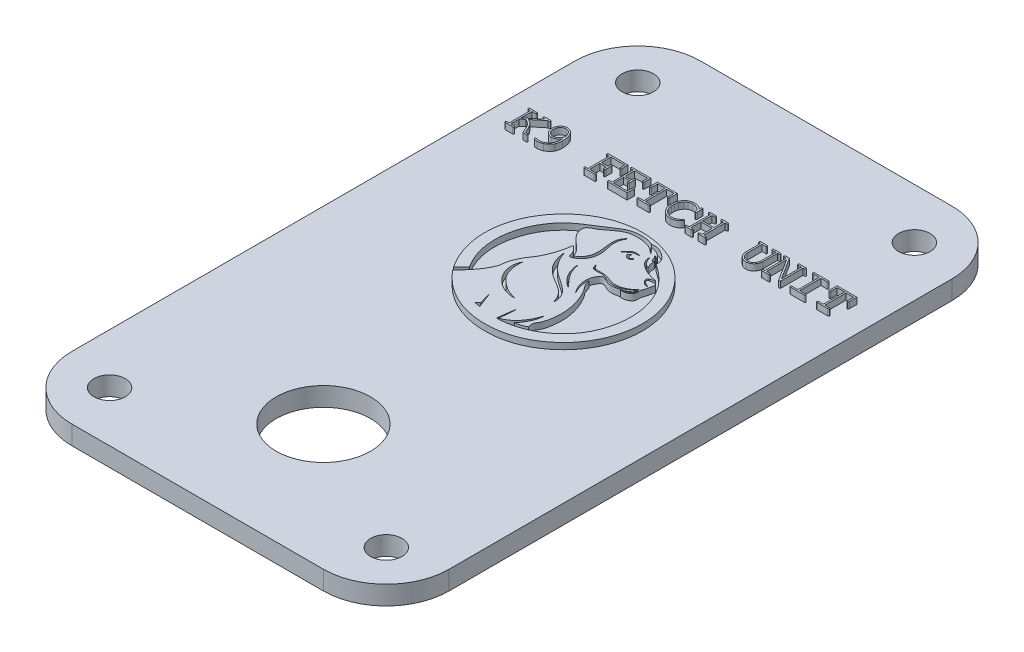
from build123d import *

# Parameters (mm, degrees)
SALIENTE_EXTRUIR1_DEPTH = 3
CORTAR_EXTRUIR1_REACH   = 60.387
CROQUIS2_R              = 7.5
CORTAR_EXTRUIR2_REACH   = 60.387
CROQUIS3_R              = 2.5
SALIENTE_EXTRUIR2_DEPTH = 1
SALIENTE_EXTRUIR3_DEPTH = 1


with BuildPart() as part:
    # Croquis1 → Saliente-Extruir1 (new body)
    with BuildSketch(Plane(origin=(0, 0, 0), x_dir=(1, 0, 0), z_dir=(0, 1, 0))):
        with BuildLine():
            Line((-30, 40), (-30, -40))
            ThreePointArc((-30, -40), (-27.071067812, -47.071067812), (-20, -50))
            Line((-20, -50), (20, -50))
            ThreePointArc((20, -50), (27.071067812, -47.071067812), (30, -40))
            Line((30, -40), (30, 40))
            ThreePointArc((30, 40), (27.071067812, 47.071067812), (20, 50))
            Line((20, 50), (-20, 50))
            ThreePointArc((-20, 50), (-27.071067812, 47.071067812), (-30, 40))
        make_face()
    extrude(amount=SALIENTE_EXTRUIR1_DEPTH)

    # Croquis2 → Cortar-Extruir1 (cut, up to next)
    with BuildSketch(Plane(origin=(0, 3, 0), x_dir=(1, 0, 0), z_dir=(0, 1, 0)), mode=Mode.PRIVATE) as cortar_extruir1_sk1:
        with Locations(Location((0, -30, 0), (0, 0, 270))):
            Circle(CROQUIS2_R)
    cortar_extruir1_tool1 = extrude(cortar_extruir1_sk1.sketch, amount=-CORTAR_EXTRUIR1_REACH, mode=Mode.PRIVATE) & part.part
    add(cortar_extruir1_tool1.solids().sort_by_distance((0, 3, 30))[0], mode=Mode.SUBTRACT)

    # Croquis3 → Cortar-Extruir2 (cut, up to next)
    with BuildSketch(Plane(origin=(0, 3, 0), x_dir=(1, 0, 0), z_dir=(0, 1, 0)), mode=Mode.PRIVATE) as cortar_extruir2_sk1:
        with Locations(Location((-22, 42, 0), (0, 0, 270))):
            Circle(CROQUIS3_R)
    cortar_extruir2_tool1 = extrude(cortar_extruir2_sk1.sketch, amount=-CORTAR_EXTRUIR2_REACH, mode=Mode.PRIVATE) & part.part
    # Croquis3 → Cortar-Extruir2 (cut, up to next)
    with BuildSketch(Plane(origin=(0, 3, 0), x_dir=(1, 0, 0), z_dir=(0, 1, 0)), mode=Mode.PRIVATE) as cortar_extruir2_sk2:
        with Locations(Location((-22, -42, 0), (0, 0, 270))):
            Circle(CROQUIS3_R)
    cortar_extruir2_tool2 = extrude(cortar_extruir2_sk2.sketch, amount=-CORTAR_EXTRUIR2_REACH, mode=Mode.PRIVATE) & part.part
    # Croquis3 → Cortar-Extruir2 (cut, up to next)
    with BuildSketch(Plane(origin=(0, 3, 0), x_dir=(1, 0, 0), z_dir=(0, 1, 0)), mode=Mode.PRIVATE) as cortar_extruir2_sk3:
        with Locations(Location((22, -42, 0), (0, 0, 270))):
            Circle(CROQUIS3_R)
    cortar_extruir2_tool3 = extrude(cortar_extruir2_sk3.sketch, amount=-CORTAR_EXTRUIR2_REACH, mode=Mode.PRIVATE) & part.part
    # Croquis3 → Cortar-Extruir2 (cut, up to next)
    with BuildSketch(Plane(origin=(0, 3, 0), x_dir=(1, 0, 0), z_dir=(0, 1, 0)), mode=Mode.PRIVATE) as cortar_extruir2_sk4:
        with Locations(Location((22, 42, 0), (0, 0, 270))):
            Circle(CROQUIS3_R)
    cortar_extruir2_tool4 = extrude(cortar_extruir2_sk4.sketch, amount=-CORTAR_EXTRUIR2_REACH, mode=Mode.PRIVATE) & part.part
    add(cortar_extruir2_tool1.solids().sort_by_distance((-22, 3, -42))[0], mode=Mode.SUBTRACT)
    add(cortar_extruir2_tool2.solids().sort_by_distance((-22, 3, 42))[0], mode=Mode.SUBTRACT)
    add(cortar_extruir2_tool3.solids().sort_by_distance((22, 3, 42))[0], mode=Mode.SUBTRACT)
    add(cortar_extruir2_tool4.solids().sort_by_distance((22, 3, -42))[0], mode=Mode.SUBTRACT)

    # Croquis4 → Saliente-Extruir2 (add)
    # profile 1 of 11: a face of its own
    with BuildSketch(Plane(origin=(0, 3, 0), x_dir=(1, 0, 0), z_dir=(0, 1, 0))):
        with BuildLine():
            Line((-25.449934436, 26.574930437), (-25.449934436, 25.251047442))
            Line((-25.449934436, 25.251047442), (-24.947839552, 25.251047442))
            add(Edge.make_bspline(
                [(-24.947839552, 25.251047442), (-24.93211662, 25.250822131), (-24.902781164, 25.250401752), (-24.862531998, 25.243607232), (-24.829202459, 25.233034569), (-24.795503578, 25.214281253), (-24.765375288, 25.178045097), (-24.761500758, 25.14308812), (-24.759553971, 25.125523721)],
                knots=[0, 0, 0, 0, 1.107723997, 2.06676398, 2.868823036, 3.560934523, 4.774472988, 6, 6, 6, 6], degree=3))
            add(Edge.make_bspline(
                [(-24.759553971, 25.125523721), (-24.761661831, 25.10865204), (-24.765968864, 25.074177804), (-24.795607846, 25.038177286), (-24.828898553, 25.017806342), (-24.862581005, 25.007528111), (-24.902765629, 25.000617826), (-24.9321112, 25.000215588), (-24.947839552, 25)],
                knots=[0, 0, 0, 0, 1.183451936, 2.418170563, 3.123878611, 3.927978125, 4.889457927, 6, 6, 6, 6], degree=3))
            Line((-24.947839552, 25), (-26.014791181, 25))
            add(Edge.make_bspline(
                [(-26.014791181, 25), (-26.030529357, 25.000170431), (-26.059570449, 25.000484922), (-26.099634342, 25.007853737), (-26.133487885, 25.017566752), (-26.167012596, 25.038212936), (-26.196664852, 25.074167469), (-26.200969882, 25.108648644), (-26.203076763, 25.125523721)],
                knots=[0, 0, 0, 0, 1.11069315, 2.049522198, 2.87569642, 3.581500471, 4.816387068, 6, 6, 6, 6], degree=3))
            add(Edge.make_bspline(
                [(-26.203076763, 25.125523721), (-26.201131081, 25.14309183), (-26.197258751, 25.17805619), (-26.167116422, 25.21424523), (-26.133178834, 25.233264146), (-26.099682491, 25.243279956), (-26.059555053, 25.250534941), (-26.030523946, 25.250867318), (-26.014791181, 25.251047442)],
                knots=[0, 0, 0, 0, 1.225693308, 2.439396442, 3.131601845, 3.955679308, 4.892125692, 6, 6, 6, 6], degree=3))
            Line((-26.014791181, 25.251047442), (-25.700981878, 25.251047442))
            Line((-25.700981878, 25.251047442), (-25.700981878, 28.64018791))
            Line((-25.700981878, 28.64018791), (-26.014791181, 28.64018791))
            add(Edge.make_bspline(
                [(-26.014791181, 28.64018791), (-26.030523946, 28.640368034), (-26.059555053, 28.64070041), (-26.099682491, 28.647955396), (-26.133178834, 28.657971205), (-26.167116422, 28.676990121), (-26.197258751, 28.713179161), (-26.201131081, 28.748143522), (-26.203076763, 28.765711631)],
                knots=[0, 0, 0, 0, 1.107874308, 2.044320692, 2.868398155, 3.560603558, 4.774306692, 6, 6, 6, 6], degree=3))
            add(Edge.make_bspline(
                [(-26.203076763, 28.765711631), (-26.201131081, 28.78327974), (-26.197258751, 28.8182441), (-26.167116422, 28.85443314), (-26.133178834, 28.873452056), (-26.099682491, 28.883467865), (-26.059555053, 28.890722851), (-26.030523946, 28.891055227), (-26.014791181, 28.891235352)],
                knots=[0, 0, 0, 0, 1.225693308, 2.439396442, 3.131601845, 3.955679308, 4.892125692, 6, 6, 6, 6], degree=3))
            Line((-26.014791181, 28.891235352), (-24.947839552, 28.891235352))
            add(Edge.make_bspline(
                [(-24.947839552, 28.891235352), (-24.93211662, 28.891010041), (-24.902781164, 28.890589662), (-24.862531998, 28.883795142), (-24.829202459, 28.873222478), (-24.795503578, 28.854469163), (-24.765375288, 28.818233006), (-24.761500758, 28.78327603), (-24.759553971, 28.765711631)],
                knots=[0, 0, 0, 0, 1.107723997, 2.06676398, 2.868823036, 3.560934523, 4.774472988, 6, 6, 6, 6], degree=3))
            add(Edge.make_bspline(
                [(-24.759553971, 28.765711631), (-24.761500758, 28.748147232), (-24.765375288, 28.713190255), (-24.795503578, 28.676954098), (-24.829202459, 28.658200783), (-24.862531998, 28.647628119), (-24.902781164, 28.6408336), (-24.93211662, 28.64041322), (-24.947839552, 28.64018791)],
                knots=[0, 0, 0, 0, 1.225527012, 2.439065477, 3.131176964, 3.93323602, 4.892276003, 6, 6, 6, 6], degree=3))
            Line((-24.947839552, 28.64018791), (-25.449934436, 28.64018791))
            Line((-25.449934436, 28.64018791), (-25.449934436, 26.883836469))
            Line((-25.449934436, 26.883836469), (-23.320934449, 28.64018791))
            Line((-23.320934449, 28.64018791), (-23.629840482, 28.64018791))
            add(Edge.make_bspline(
                [(-23.629840482, 28.64018791), (-23.645563414, 28.64041322), (-23.67489887, 28.6408336), (-23.715148036, 28.647628119), (-23.748477575, 28.658200783), (-23.782176456, 28.676954098), (-23.812304746, 28.713190255), (-23.816179276, 28.748147232), (-23.818126063, 28.765711631)],
                knots=[0, 0, 0, 0, 1.107723997, 2.06676398, 2.868823036, 3.560934523, 4.774472988, 6, 6, 6, 6], degree=3))
            add(Edge.make_bspline(
                [(-23.818126063, 28.765711631), (-23.816179276, 28.78327603), (-23.812304746, 28.818233006), (-23.782176456, 28.854469163), (-23.748477575, 28.873222478), (-23.715148036, 28.883795142), (-23.67489887, 28.890589662), (-23.645563414, 28.891010041), (-23.629840482, 28.891235352)],
                knots=[0, 0, 0, 0, 1.225527012, 2.439065477, 3.131176964, 3.93323602, 4.892276003, 6, 6, 6, 6], degree=3))
            Line((-23.629840482, 28.891235352), (-22.813936295, 28.891235352))
            add(Edge.make_bspline(
                [(-22.813936295, 28.891235352), (-22.798207502, 28.891040462), (-22.769183724, 28.890680839), (-22.729316502, 28.883653345), (-22.69624892, 28.87325502), (-22.662525111, 28.854258636), (-22.631309233, 28.81860564), (-22.627535554, 28.783330507), (-22.625650714, 28.765711631)],
                knots=[0, 0, 0, 0, 1.109227365, 2.046817439, 2.849965025, 3.543015824, 4.772809742, 6, 6, 6, 6], degree=3))
            add(Edge.make_bspline(
                [(-22.625650714, 28.765711631), (-22.627535554, 28.748092754), (-22.631309233, 28.712817621), (-22.662525111, 28.677164625), (-22.69624892, 28.658168241), (-22.729316502, 28.647769916), (-22.769183724, 28.640742422), (-22.798207502, 28.640382799), (-22.813936295, 28.64018791)],
                knots=[0, 0, 0, 0, 1.227190258, 2.456984176, 3.150034975, 3.953182561, 4.890772635, 6, 6, 6, 6], degree=3))
            Line((-22.813936295, 28.64018791), (-22.946324595, 28.64018791))
            Line((-22.946324595, 28.64018791), (-24.636972212, 27.245697821))
            add(Edge.make_bspline(
                [(-24.636972212, 27.245697821), (-24.579305991, 27.220842292), (-24.467060226, 27.172461667), (-24.310189299, 27.085396051), (-24.168437002, 26.98954951), (-24.039783501, 26.881963478), (-23.920288249, 26.759826128), (-23.805143122, 26.619200474), (-23.692677112, 26.458181171), (-23.622893436, 26.34134527), (-23.586691703, 26.280734216)],
                knots=[0, 0, 0, 0, 1.03360786, 2.011890186, 2.949561397, 3.847657483, 4.768866103, 5.759336214, 6.83760906, 8, 8, 8, 8], degree=3))
            add(Edge.make_bspline(
                [(-23.586691703, 26.280734216), (-23.575116805, 26.259884867), (-23.548781311, 26.212447913), (-23.507856085, 26.13054217), (-23.460203643, 26.030135411), (-23.406158099, 25.910706685), (-23.345471527, 25.772843368), (-23.278853821, 25.615434046), (-23.20569427, 25.439406508), (-23.154532961, 25.315777766), (-23.127745598, 25.251047442)],
                knots=[0, 0, 0, 0, 0.507387629, 1.154420875, 1.947802053, 2.872313638, 3.943700596, 5.15295928, 6.509328283, 8, 8, 8, 8], degree=3))
            Line((-23.127745598, 25.251047442), (-22.780594057, 25.251047442))
            add(Edge.make_bspline(
                [(-22.780594057, 25.251047442), (-22.764538705, 25.250846435), (-22.734866232, 25.250474947), (-22.694344405, 25.243540932), (-22.66113498, 25.233312842), (-22.628212144, 25.213805058), (-22.598084675, 25.178121554), (-22.594240174, 25.143113689), (-22.592308475, 25.125523721)],
                knots=[0, 0, 0, 0, 1.130165903, 2.088700321, 2.890336566, 3.562220294, 4.775119033, 6, 6, 6, 6], degree=3))
            add(Edge.make_bspline(
                [(-22.592308475, 25.125523721), (-22.594400728, 25.108627313), (-22.598675869, 25.07410255), (-22.628339102, 25.038660421), (-22.660818586, 25.017528177), (-22.694396351, 25.007595329), (-22.73484937, 25.000543664), (-22.764532785, 25.000190884), (-22.780594057, 25)],
                knots=[0, 0, 0, 0, 1.182758753, 2.416754169, 3.102480166, 3.906108694, 4.867025329, 6, 6, 6, 6], degree=3))
            Line((-22.780594057, 25), (-23.284650249, 25))
            add(Edge.make_bspline(
                [(-23.284650249, 25), (-23.322163882, 25.094633928), (-23.394112533, 25.276135505), (-23.503567795, 25.533508531), (-23.608803286, 25.764555488), (-23.707759715, 25.969681954), (-23.803803781, 26.147624826), (-23.895089346, 26.299123755), (-23.979792016, 26.425924636), (-24.090565417, 26.556763475), (-24.235912594, 26.693511301), (-24.425232192, 26.836851207), (-24.635378705, 26.960448857), (-24.786559114, 27.025357332), (-24.863503302, 27.058392894)],
                knots=[0, 0, 0, 0, 1.363393993, 2.614898971, 3.745385154, 4.763567167, 5.664703726, 6.452338368, 7.132399048, 7.704174621, 8.744656085, 9.798035985, 10.879297041, 12, 12, 12, 12], degree=3))
            Line((-24.863503302, 27.058392894), (-25.449934436, 26.574930437))
        make_face()
    # profile 2 of 11: a face of its own
    with BuildSketch(Plane(origin=(0, 3, 0), x_dir=(1, 0, 0), z_dir=(0, 1, 0))):
        with BuildLine():
            add(Edge.make_bspline(
                [(-19.278678371, 27.322188839), (-19.315421499, 27.2676986), (-19.387026155, 27.161508545), (-19.511548026, 27.020647003), (-19.64554972, 26.900160078), (-19.790056837, 26.803243409), (-19.940382669, 26.727852439), (-20.093082557, 26.671837265), (-20.248708557, 26.638134009), (-20.353317336, 26.633912296), (-20.405449898, 26.631808373)],
                knots=[0, 0, 0, 0, 1.142461317, 2.22641764, 3.261716095, 4.269675264, 5.24382165, 6.181128626, 7.093551932, 8, 8, 8, 8], degree=3))
            add(Edge.make_bspline(
                [(-20.405449898, 26.631808373), (-20.453668562, 26.633593459), (-20.550092561, 26.637163136), (-20.692871666, 26.66947628), (-20.833086556, 26.719994429), (-20.969880776, 26.788998145), (-21.09863894, 26.878004293), (-21.21403976, 26.987222678), (-21.316348655, 27.114330957), (-21.402001806, 27.258337129), (-21.47123208, 27.413164149), (-21.521248241, 27.573788191), (-21.553477346, 27.738333977), (-21.556950261, 27.849632471), (-21.558699085, 27.905678011)],
                knots=[0, 0, 0, 0, 0.909191235, 1.81813115, 2.749172904, 3.717817579, 4.702080115, 5.693032032, 6.706852157, 7.77252907, 8.847048449, 9.900958498, 10.943005356, 12, 12, 12, 12], degree=3))
            add(Edge.make_bspline(
                [(-21.558699085, 27.905678011), (-21.557741628, 27.946248966), (-21.55584349, 28.026679971), (-21.541111144, 28.145957837), (-21.514723347, 28.26204771), (-21.481424482, 28.376149044), (-21.434968738, 28.486316998), (-21.381315398, 28.595044161), (-21.316463691, 28.700573483), (-21.242309465, 28.802126328), (-21.16068126, 28.896458165), (-21.070200882, 28.979099469), (-20.973032775, 29.048770898), (-20.869159462, 29.106343527), (-20.758463294, 29.150825755), (-20.64111964, 29.181538556), (-20.517337216, 29.202494858), (-20.432345555, 29.204180561), (-20.388778779, 29.205044654)],
                knots=[0, 0, 0, 0, 1.000287807, 1.98304805, 2.956976254, 3.933602372, 4.909529746, 5.900813997, 6.921005661, 7.959250747, 8.998809079, 9.991566872, 10.9735335, 11.94039846, 12.913292149, 13.906540638, 14.926891495, 16, 16, 16, 16], degree=3))
            add(Edge.make_bspline(
                [(-20.388778779, 29.205044654), (-20.357366628, 29.204232112), (-20.295013711, 29.202619221), (-20.20288263, 29.191524872), (-20.112604634, 29.173958242), (-20.024750548, 29.148421986), (-19.938939958, 29.115742101), (-19.8550606, 29.076564821), (-19.773751522, 29.029071094), (-19.694325356, 28.975200345), (-19.617730197, 28.914796557), (-19.546356992, 28.846458363), (-19.478095668, 28.773048457), (-19.41542586, 28.69191857), (-19.356585788, 28.604895415), (-19.302643736, 28.510967432), (-19.252365868, 28.411301484), (-19.223628521, 28.341294743), (-19.209051932, 28.305784872)],
                knots=[0, 0, 0, 0, 0.953383653, 1.892460407, 2.812899892, 3.74243995, 4.665709673, 5.597841121, 6.549208888, 7.520699293, 8.50936777, 9.5060699, 10.517285969, 11.549413669, 12.614451149, 13.703665429, 14.83521864, 16, 16, 16, 16], degree=3))
            add(Edge.make_bspline(
                [(-19.209051932, 28.305784872), (-19.191268936, 28.258220998), (-19.155270357, 28.161936219), (-19.109279826, 28.013109587), (-19.071190548, 27.858476578), (-19.039687791, 27.698128002), (-19.015549139, 27.531842283), (-18.997600121, 27.360114663), (-18.988161234, 27.182715085), (-18.986373257, 27.062652097), (-18.985462804, 27.001514958)],
                knots=[0, 0, 0, 0, 0.915425346, 1.853119226, 2.806554319, 3.785567936, 4.798275899, 5.835117902, 6.897622829, 8, 8, 8, 8], degree=3))
            add(Edge.make_bspline(
                [(-18.985462804, 27.001514958), (-18.98600471, 26.954429521), (-18.987066934, 26.86213449), (-18.996066051, 26.726647461), (-19.010594653, 26.59736075), (-19.030897515, 26.473785814), (-19.058691021, 26.356785482), (-19.090528893, 26.24506294), (-19.129904264, 26.140096037), (-19.160607889, 26.073318831), (-19.175709694, 26.040473969)],
                knots=[0, 0, 0, 0, 1.143476622, 2.241398129, 3.296102199, 4.3023952, 5.28067631, 6.215265706, 7.122165255, 8, 8, 8, 8], degree=3))
            add(Edge.make_bspline(
                [(-19.175709694, 26.040473969), (-19.198887871, 25.997254864), (-19.246242504, 25.908955216), (-19.332013997, 25.781159801), (-19.433974232, 25.656626998), (-19.548613313, 25.535315544), (-19.674213602, 25.419844025), (-19.809607641, 25.315305324), (-19.952298546, 25.220963444), (-20.052923466, 25.16785797), (-20.103408444, 25.141214186)],
                knots=[0, 0, 0, 0, 0.895891164, 1.830368206, 2.807211692, 3.834120596, 4.878534695, 5.921717938, 6.957295815, 8, 8, 8, 8], degree=3))
            add(Edge.make_bspline(
                [(-20.103408444, 25.141214186), (-20.175360448, 25.10980391), (-20.316971169, 25.04798448), (-20.537379914, 24.98504208), (-20.758296182, 24.944604192), (-20.906391654, 24.939686269), (-20.980113183, 24.937238139)],
                knots=[0, 0, 0, 0, 1.037576248, 2.042082376, 3.025353844, 4, 4, 4, 4], degree=3))
            add(Edge.make_bspline(
                [(-20.980113183, 24.937238139), (-21.027900809, 24.938630939), (-21.119612508, 24.941303933), (-21.250391379, 24.959359467), (-21.36781435, 24.990937605), (-21.43779626, 25.023554524), (-21.471420873, 25.039226163)],
                knots=[0, 0, 0, 0, 1.132284987, 2.173026561, 3.122183533, 4, 4, 4, 4], degree=3))
            add(Edge.make_bspline(
                [(-21.471420873, 25.039226163), (-21.484554726, 25.047188266), (-21.508984037, 25.061997987), (-21.537797413, 25.090744395), (-21.554881098, 25.123929293), (-21.557429599, 25.147249467), (-21.558699085, 25.158865959)],
                knots=[0, 0, 0, 0, 1.18310948, 2.200614565, 3.103670998, 4, 4, 4, 4], degree=3))
            add(Edge.make_bspline(
                [(-21.558699085, 25.158865959), (-21.556877237, 25.175742533), (-21.553161396, 25.210164002), (-21.520178573, 25.252240938), (-21.475376033, 25.282916218), (-21.439549318, 25.286498376), (-21.421407515, 25.288312297)],
                knots=[0, 0, 0, 0, 0.960028748, 1.958075128, 2.966017395, 4, 4, 4, 4], degree=3))
            add(Edge.make_bspline(
                [(-21.421407515, 25.288312297), (-21.404854132, 25.286076397), (-21.363913416, 25.280546448), (-21.326810772, 25.262059589), (-21.304709681, 25.251047442)],
                knots=[0, 0, 0, 0, 0.808651362, 2, 2, 2, 2], degree=3))
            add(Edge.make_bspline(
                [(-21.304709681, 25.251047442), (-21.282033033, 25.241321491), (-21.236299922, 25.221706686), (-21.162397597, 25.202370895), (-21.084132325, 25.190432383), (-21.030171803, 25.189010376), (-21.002668227, 25.188285582)],
                knots=[0, 0, 0, 0, 0.951209795, 1.918351636, 2.938987733, 4, 4, 4, 4], degree=3))
            add(Edge.make_bspline(
                [(-21.002668227, 25.188285582), (-20.944111241, 25.188135847), (-20.828952898, 25.187841377), (-20.659321537, 25.2068123), (-20.495975887, 25.242282329), (-20.338965401, 25.294475983), (-20.187777755, 25.362233765), (-20.044045605, 25.447638382), (-19.905976294, 25.548224168), (-19.775661802, 25.663907312), (-19.656946417, 25.79249092), (-19.551979428, 25.930453816), (-19.46331005, 26.077440895), (-19.390231691, 26.233065172), (-19.33416898, 26.397562708), (-19.295657864, 26.570594558), (-19.269845007, 26.751654297), (-19.267251969, 26.875571834), (-19.265929868, 26.938753097)],
                knots=[0, 0, 0, 0, 1.016489962, 1.999032215, 2.957928093, 3.914939359, 4.867916538, 5.830017835, 6.813527553, 7.831079438, 8.851652531, 9.848705189, 10.837070645, 11.827700475, 12.829623678, 13.84888499, 14.903220912, 16, 16, 16, 16], degree=3))
            add(Edge.make_bspline(
                [(-19.265929868, 26.938753097), (-19.266219235, 26.963923692), (-19.266846877, 27.018519244), (-19.268732013, 27.107449449), (-19.272755907, 27.210099472), (-19.276623296, 27.283294211), (-19.278678371, 27.322188839)],
                knots=[0, 0, 0, 0, 0.787274678, 1.707615429, 2.781859935, 4, 4, 4, 4], degree=3))
        make_face()
        with BuildLine():
            add(Edge.make_bspline(
                [(-19.331633691, 27.81643849), (-19.343232858, 27.871142022), (-19.365507788, 27.976194168), (-19.405477592, 28.125651429), (-19.450491297, 28.26066703), (-19.500238808, 28.381790961), (-19.554836968, 28.488876767), (-19.613834883, 28.582126496), (-19.677160836, 28.661744984), (-19.747455932, 28.725781566), (-19.819504437, 28.779901019), (-19.893641668, 28.826550337), (-19.970011609, 28.865319581), (-20.04797886, 28.898627806), (-20.12870414, 28.922725305), (-20.211326482, 28.940452197), (-20.295971861, 28.951571252), (-20.353115255, 28.953184282), (-20.3819142, 28.953997212)],
                knots=[0, 0, 0, 0, 1.574296196, 3.023263514, 4.353354554, 5.578869172, 6.706730533, 7.733101799, 8.681801137, 9.560986734, 10.402210171, 11.216831753, 12.023616736, 12.811598407, 13.600600676, 14.391265302, 15.189235006, 16, 16, 16, 16], degree=3))
            add(Edge.make_bspline(
                [(-20.3819142, 28.953997212), (-20.411395071, 28.953031222), (-20.4696963, 28.951120886), (-20.556035806, 28.936497464), (-20.640271772, 28.914809037), (-20.721614078, 28.881151405), (-20.801012426, 28.840320099), (-20.878229526, 28.789692278), (-20.952583982, 28.7293881), (-21.02448486, 28.661604178), (-21.091284166, 28.586694384), (-21.148693457, 28.505037316), (-21.198908406, 28.419274119), (-21.237723662, 28.326973023), (-21.269084047, 28.23023281), (-21.292102132, 28.128219882), (-21.304402714, 28.021044038), (-21.30655477, 27.947874686), (-21.307651643, 27.910581281)],
                knots=[0, 0, 0, 0, 0.913360565, 1.806257438, 2.7083066, 3.603958979, 4.528492566, 5.472804511, 6.460274239, 7.492430743, 8.53335359, 9.565211625, 10.581984009, 11.607804378, 12.662056599, 13.731441822, 14.843747349, 16, 16, 16, 16], degree=3))
            add(Edge.make_bspline(
                [(-21.307651643, 27.910581281), (-21.306987309, 27.874259265), (-21.30567829, 27.802689545), (-21.292720719, 27.697965533), (-21.271311617, 27.598080229), (-21.240354798, 27.503436002), (-21.202392527, 27.412829691), (-21.155367055, 27.327121877), (-21.098420602, 27.247437556), (-21.035719852, 27.172374905), (-20.966259967, 27.105210096), (-20.893762969, 27.046578201), (-20.819720047, 26.995643296), (-20.743237071, 26.954263148), (-20.663866455, 26.922537118), (-20.58258833, 26.900252423), (-20.499122382, 26.885757936), (-20.442774356, 26.88383059), (-20.414275785, 26.882855815)],
                knots=[0, 0, 0, 0, 1.153725065, 2.273325946, 3.347030533, 4.394900595, 5.432838996, 6.464939795, 7.493742385, 8.540427685, 9.568810699, 10.558376753, 11.500465677, 12.420654689, 13.315641276, 14.210266131, 15.094824393, 16, 16, 16, 16], degree=3))
            add(Edge.make_bspline(
                [(-20.414275785, 26.882855815), (-20.381167485, 26.884268477), (-20.314388779, 26.887117784), (-20.214892746, 26.907632277), (-20.116202842, 26.940249412), (-20.018100298, 26.985948892), (-19.920906152, 27.045855218), (-19.822888089, 27.117300483), (-19.725409098, 27.202245077), (-19.663619356, 27.265823847), (-19.631713836, 27.298653141)],
                knots=[0, 0, 0, 0, 0.871472716, 1.757741146, 2.664179041, 3.603848977, 4.600310344, 5.666044228, 6.794847365, 8, 8, 8, 8], degree=3))
            add(Edge.make_bspline(
                [(-19.631713836, 27.298653141), (-19.620026044, 27.311527603), (-19.595452095, 27.338596562), (-19.561674443, 27.385747102), (-19.524619082, 27.438674633), (-19.488329864, 27.499997068), (-19.450523536, 27.568739317), (-19.411754609, 27.644681806), (-19.371509177, 27.728046149), (-19.345228511, 27.786302733), (-19.331633691, 27.81643849)],
                knots=[0, 0, 0, 0, 0.693964903, 1.459082915, 2.313763215, 3.274373637, 4.302861506, 5.447377744, 6.679544894, 8, 8, 8, 8], degree=3))
        make_face(mode=Mode.SUBTRACT)
    # profile 3 of 11: a face of its own
    with BuildSketch(Plane(origin=(0, 3, 0), x_dir=(1, 0, 0), z_dir=(0, 1, 0))):
        with BuildLine():
            Line((-12.897562335, 26.882855815), (-12.897562335, 25.251047442))
            Line((-12.897562335, 25.251047442), (-11.956134427, 25.251047442))
            add(Edge.make_bspline(
                [(-11.956134427, 25.251047442), (-11.940405634, 25.250852552), (-11.911381856, 25.250492929), (-11.871514634, 25.243465436), (-11.838447051, 25.233067111), (-11.804723243, 25.214070727), (-11.773507365, 25.178417731), (-11.769733686, 25.143142597), (-11.767848845, 25.125523721)],
                knots=[0, 0, 0, 0, 1.109227365, 2.046817439, 2.849965025, 3.543015824, 4.772809742, 6, 6, 6, 6], degree=3))
            add(Edge.make_bspline(
                [(-11.767848845, 25.125523721), (-11.769897741, 25.108601672), (-11.774109245, 25.073818415), (-11.804837003, 25.038392961), (-11.838142917, 25.01777415), (-11.871562317, 25.007667293), (-11.911366454, 25.000526964), (-11.94040022, 25.000185208), (-11.956134427, 25)],
                knots=[0, 0, 0, 0, 1.185104068, 2.435980483, 3.142673719, 3.947895778, 4.88790758, 6, 6, 6, 6], degree=3))
            Line((-11.956134427, 25), (-13.462419079, 25))
            add(Edge.make_bspline(
                [(-13.462419079, 25), (-13.478157255, 25.000170431), (-13.507198347, 25.000484922), (-13.54726224, 25.007853737), (-13.581115783, 25.017566752), (-13.614640495, 25.038212936), (-13.644292751, 25.074167469), (-13.64859778, 25.108648644), (-13.650704661, 25.125523721)],
                knots=[0, 0, 0, 0, 1.11069315, 2.049522198, 2.87569642, 3.581500471, 4.816387068, 6, 6, 6, 6], degree=3))
            add(Edge.make_bspline(
                [(-13.650704661, 25.125523721), (-13.648758979, 25.14309183), (-13.644886649, 25.17805619), (-13.61474432, 25.21424523), (-13.580806732, 25.233264146), (-13.547310389, 25.243279956), (-13.507182952, 25.250534941), (-13.478151844, 25.250867318), (-13.462419079, 25.251047442)],
                knots=[0, 0, 0, 0, 1.225693308, 2.439396442, 3.131601845, 3.955679308, 4.892125692, 6, 6, 6, 6], degree=3))
            Line((-13.462419079, 25.251047442), (-13.148609777, 25.251047442))
            Line((-13.148609777, 25.251047442), (-13.148609777, 28.64018791))
            Line((-13.148609777, 28.64018791), (-13.462419079, 28.64018791))
            add(Edge.make_bspline(
                [(-13.462419079, 28.64018791), (-13.478151844, 28.640368034), (-13.507182952, 28.64070041), (-13.547310389, 28.647955396), (-13.580806732, 28.657971205), (-13.61474432, 28.676990121), (-13.644886649, 28.713179161), (-13.648758979, 28.748143522), (-13.650704661, 28.765711631)],
                knots=[0, 0, 0, 0, 1.107874308, 2.044320692, 2.868398155, 3.560603558, 4.774306692, 6, 6, 6, 6], degree=3))
            add(Edge.make_bspline(
                [(-13.650704661, 28.765711631), (-13.648316106, 28.784318794), (-13.643427403, 28.822402457), (-13.615151819, 28.848479551), (-13.600691303, 28.861815729)],
                knots=[0, 0, 0, 0, 0.977172953, 2, 2, 2, 2], degree=3))
            add(Edge.make_bspline(
                [(-13.600691303, 28.861815729), (-13.593321679, 28.866367224), (-13.576866001, 28.876530285), (-13.545421068, 28.886034268), (-13.506330048, 28.88990895), (-13.477789163, 28.890771074), (-13.462419079, 28.891235352)],
                knots=[0, 0, 0, 0, 0.722113295, 1.612411138, 2.714215055, 4, 4, 4, 4], degree=3))
            Line((-13.462419079, 28.891235352), (-10.449849775, 28.891235352))
            Line((-10.449849775, 28.891235352), (-10.449849775, 27.949807444))
            add(Edge.make_bspline(
                [(-10.449849775, 27.949807444), (-10.45001909, 27.934067801), (-10.450331522, 27.905024004), (-10.457713442, 27.86497733), (-10.467386042, 27.831070691), (-10.487917707, 27.798185033), (-10.522267767, 27.767465443), (-10.556436979, 27.763494581), (-10.573412188, 27.761521862)],
                knots=[0, 0, 0, 0, 1.117400903, 2.061899775, 2.893063469, 3.603130048, 4.809238934, 6, 6, 6, 6], degree=3))
            add(Edge.make_bspline(
                [(-10.573412188, 27.761521862), (-10.590978959, 27.763507621), (-10.626199344, 27.767488954), (-10.662685748, 27.797588295), (-10.683330109, 27.831110191), (-10.693043596, 27.864964462), (-10.700412258, 27.905028119), (-10.700726772, 27.934069248), (-10.700897217, 27.949807444)],
                knots=[0, 0, 0, 0, 1.219624293, 2.445277839, 3.145804706, 3.965801753, 4.897611327, 6, 6, 6, 6], degree=3))
            Line((-10.700897217, 27.949807444), (-10.700897217, 28.64018791))
            Line((-10.700897217, 28.64018791), (-12.897562335, 28.64018791))
            Line((-12.897562335, 28.64018791), (-12.897562335, 27.133903257))
            Line((-12.897562335, 27.133903257), (-11.893372566, 27.133903257))
            Line((-11.893372566, 27.133903257), (-11.893372566, 27.44771256))
            add(Edge.make_bspline(
                [(-11.893372566, 27.44771256), (-11.893187342, 27.463446782), (-11.892845554, 27.492480576), (-11.885705422, 27.532284535), (-11.87559797, 27.565704475), (-11.854981523, 27.599008247), (-11.819030516, 27.630192456), (-11.783503945, 27.63407361), (-11.765887537, 27.635998141)],
                knots=[0, 0, 0, 0, 1.103767085, 2.03674178, 2.835935793, 3.537338589, 4.778850706, 6, 6, 6, 6], degree=3))
            add(Edge.make_bspline(
                [(-11.765887537, 27.635998141), (-11.748863294, 27.634082421), (-11.714381877, 27.630202263), (-11.680581546, 27.59841636), (-11.660068594, 27.565742961), (-11.650002611, 27.532271748), (-11.642848796, 27.492484707), (-11.642509175, 27.463448233), (-11.642325124, 27.44771256)],
                knots=[0, 0, 0, 0, 1.192184638, 2.414686749, 3.125602223, 3.935635194, 4.881263228, 6, 6, 6, 6], degree=3))
            Line((-11.642325124, 27.44771256), (-11.642325124, 26.569046513))
            add(Edge.make_bspline(
                [(-11.642325124, 26.569046513), (-11.64249444, 26.55330687), (-11.642806871, 26.524263073), (-11.650188792, 26.484216399), (-11.659861392, 26.45030976), (-11.680393057, 26.417424102), (-11.714743117, 26.386704512), (-11.748912329, 26.382733649), (-11.765887537, 26.380760931)],
                knots=[0, 0, 0, 0, 1.117400903, 2.061899775, 2.893063469, 3.603130048, 4.809238934, 6, 6, 6, 6], degree=3))
            add(Edge.make_bspline(
                [(-11.765887537, 26.380760931), (-11.783454309, 26.38274669), (-11.818674694, 26.386728023), (-11.855161097, 26.416827363), (-11.875805459, 26.45034926), (-11.885518946, 26.484203531), (-11.892887607, 26.524267188), (-11.893202122, 26.553308316), (-11.893372566, 26.569046513)],
                knots=[0, 0, 0, 0, 1.219624293, 2.445277839, 3.145804706, 3.965801753, 4.897611327, 6, 6, 6, 6], degree=3))
            Line((-11.893372566, 26.569046513), (-11.893372566, 26.882855815))
            Line((-11.893372566, 26.882855815), (-12.897562335, 26.882855815))
        make_face()
    # profile 4 of 11: a face of its own
    with BuildSketch(Plane(origin=(0, 3, 0), x_dir=(1, 0, 0), z_dir=(0, 1, 0))):
        with BuildLine():
            Line((-9.131850704, 26.882855815), (-9.131850704, 25.251047442))
            Line((-9.131850704, 25.251047442), (-6.935185586, 25.251047442))
            Line((-6.935185586, 25.251047442), (-6.935185586, 26.066951629))
            add(Edge.make_bspline(
                [(-6.935185586, 26.066951629), (-6.934990697, 26.082680422), (-6.934631073, 26.1117042), (-6.92760358, 26.151571422), (-6.917205255, 26.184639004), (-6.898208871, 26.218362812), (-6.862555875, 26.249578691), (-6.827280742, 26.25335237), (-6.809661865, 26.25523721)],
                knots=[0, 0, 0, 0, 1.109227365, 2.046817439, 2.849965025, 3.543015824, 4.772809742, 6, 6, 6, 6], degree=3))
            add(Edge.make_bspline(
                [(-6.809661865, 26.25523721), (-6.792042989, 26.25335237), (-6.756767855, 26.249578691), (-6.721114859, 26.218362812), (-6.702118475, 26.184639004), (-6.69172015, 26.151571422), (-6.684692657, 26.1117042), (-6.684333034, 26.082680422), (-6.684138144, 26.066951629)],
                knots=[0, 0, 0, 0, 1.227190258, 2.456984176, 3.150034975, 3.953182561, 4.890772635, 6, 6, 6, 6], degree=3))
            Line((-6.684138144, 26.066951629), (-6.684138144, 25))
            Line((-6.684138144, 25), (-9.696707449, 25))
            add(Edge.make_bspline(
                [(-9.696707449, 25), (-9.712445625, 25.000170431), (-9.741486717, 25.000484922), (-9.781550609, 25.007853737), (-9.815404152, 25.017566752), (-9.848928864, 25.038212936), (-9.87858112, 25.074167469), (-9.88288615, 25.108648644), (-9.88499303, 25.125523721)],
                knots=[0, 0, 0, 0, 1.11069315, 2.049522198, 2.87569642, 3.581500471, 4.816387068, 6, 6, 6, 6], degree=3))
            add(Edge.make_bspline(
                [(-9.88499303, 25.125523721), (-9.883047348, 25.14309183), (-9.879175018, 25.17805619), (-9.849032689, 25.21424523), (-9.815095102, 25.233264146), (-9.781598758, 25.243279956), (-9.741471321, 25.250534941), (-9.712440214, 25.250867318), (-9.696707449, 25.251047442)],
                knots=[0, 0, 0, 0, 1.225693308, 2.439396442, 3.131601845, 3.955679308, 4.892125692, 6, 6, 6, 6], degree=3))
            Line((-9.696707449, 25.251047442), (-9.382898146, 25.251047442))
            Line((-9.382898146, 25.251047442), (-9.382898146, 28.64018791))
            Line((-9.382898146, 28.64018791), (-9.696707449, 28.64018791))
            add(Edge.make_bspline(
                [(-9.696707449, 28.64018791), (-9.712440214, 28.640368034), (-9.741471321, 28.64070041), (-9.781598758, 28.647955396), (-9.815095102, 28.657971205), (-9.849032689, 28.676990121), (-9.879175018, 28.713179161), (-9.883047348, 28.748143522), (-9.88499303, 28.765711631)],
                knots=[0, 0, 0, 0, 1.107874308, 2.044320692, 2.868398155, 3.560603558, 4.774306692, 6, 6, 6, 6], degree=3))
            add(Edge.make_bspline(
                [(-9.88499303, 28.765711631), (-9.883047348, 28.78327974), (-9.879175018, 28.8182441), (-9.849032689, 28.85443314), (-9.815095102, 28.873452056), (-9.781598758, 28.883467865), (-9.741471321, 28.890722851), (-9.712440214, 28.891055227), (-9.696707449, 28.891235352)],
                knots=[0, 0, 0, 0, 1.225693308, 2.439396442, 3.131601845, 3.955679308, 4.892125692, 6, 6, 6, 6], degree=3))
            Line((-9.696707449, 28.891235352), (-6.809661865, 28.891235352))
            Line((-6.809661865, 28.891235352), (-6.809661865, 27.949807444))
            add(Edge.make_bspline(
                [(-6.809661865, 27.949807444), (-6.809841989, 27.934074679), (-6.810174366, 27.905043572), (-6.817429352, 27.864916134), (-6.827445161, 27.831419791), (-6.846464077, 27.797482203), (-6.882653117, 27.767339874), (-6.917617477, 27.763467544), (-6.935185586, 27.761521862)],
                knots=[0, 0, 0, 0, 1.107874308, 2.044320692, 2.868398155, 3.560603558, 4.774306692, 6, 6, 6, 6], degree=3))
            add(Edge.make_bspline(
                [(-6.935185586, 27.761521862), (-6.952753695, 27.763467544), (-6.987718056, 27.767339874), (-7.023907096, 27.797482203), (-7.042926011, 27.831419791), (-7.052941821, 27.864916134), (-7.060196806, 27.905043572), (-7.060529183, 27.934074679), (-7.060709307, 27.949807444)],
                knots=[0, 0, 0, 0, 1.225693308, 2.439396442, 3.131601845, 3.955679308, 4.892125692, 6, 6, 6, 6], degree=3))
            Line((-7.060709307, 27.949807444), (-7.060709307, 28.64018791))
            Line((-7.060709307, 28.64018791), (-9.131850704, 28.64018791))
            Line((-9.131850704, 28.64018791), (-9.131850704, 27.133903257))
            Line((-9.131850704, 27.133903257), (-8.127660936, 27.133903257))
            Line((-8.127660936, 27.133903257), (-8.127660936, 27.44771256))
            add(Edge.make_bspline(
                [(-8.127660936, 27.44771256), (-8.127475711, 27.463446782), (-8.127133923, 27.492480576), (-8.119993792, 27.532284535), (-8.109886339, 27.565704475), (-8.089269892, 27.599008247), (-8.053318886, 27.630192456), (-8.017792314, 27.63407361), (-8.000175907, 27.635998141)],
                knots=[0, 0, 0, 0, 1.103767085, 2.03674178, 2.835935793, 3.537338589, 4.778850706, 6, 6, 6, 6], degree=3))
            add(Edge.make_bspline(
                [(-8.000175907, 27.635998141), (-7.983151663, 27.634082421), (-7.948670246, 27.630202263), (-7.914869915, 27.59841636), (-7.894356963, 27.565742961), (-7.884290981, 27.532271748), (-7.877137166, 27.492484707), (-7.876797544, 27.463448233), (-7.876613494, 27.44771256)],
                knots=[0, 0, 0, 0, 1.192184638, 2.414686749, 3.125602223, 3.935635194, 4.881263228, 6, 6, 6, 6], degree=3))
            Line((-7.876613494, 27.44771256), (-7.876613494, 26.569046513))
            add(Edge.make_bspline(
                [(-7.876613494, 26.569046513), (-7.876782809, 26.55330687), (-7.877095241, 26.524263073), (-7.884477161, 26.484216399), (-7.894149761, 26.45030976), (-7.914681427, 26.417424102), (-7.949031486, 26.386704512), (-7.983200698, 26.382733649), (-8.000175907, 26.380760931)],
                knots=[0, 0, 0, 0, 1.117400903, 2.061899775, 2.893063469, 3.603130048, 4.809238934, 6, 6, 6, 6], degree=3))
            add(Edge.make_bspline(
                [(-8.000175907, 26.380760931), (-8.017742678, 26.38274669), (-8.052963064, 26.386728023), (-8.089449467, 26.416827363), (-8.110093829, 26.45034926), (-8.119807315, 26.484203531), (-8.127175977, 26.524267188), (-8.127490492, 26.553308316), (-8.127660936, 26.569046513)],
                knots=[0, 0, 0, 0, 1.219624293, 2.445277839, 3.145804706, 3.965801753, 4.897611327, 6, 6, 6, 6], degree=3))
            Line((-8.127660936, 26.569046513), (-8.127660936, 26.882855815))
            Line((-8.127660936, 26.882855815), (-9.131850704, 26.882855815))
        make_face()
    # profile 5 of 11: a face of its own
    with BuildSketch(Plane(origin=(0, 3, 0), x_dir=(1, 0, 0), z_dir=(0, 1, 0))):
        with BuildLine():
            Line((-4.048140003, 28.64018791), (-4.048140003, 25.251047442))
            Line((-4.048140003, 25.251047442), (-3.357759537, 25.251047442))
            add(Edge.make_bspline(
                [(-3.357759537, 25.251047442), (-3.342030744, 25.250852552), (-3.313006966, 25.250492929), (-3.273139744, 25.243465436), (-3.240072162, 25.233067111), (-3.206348354, 25.214070727), (-3.175132475, 25.178417731), (-3.171358796, 25.143142597), (-3.169473956, 25.125523721)],
                knots=[0, 0, 0, 0, 1.109227365, 2.046817439, 2.849965025, 3.543015824, 4.772809742, 6, 6, 6, 6], degree=3))
            add(Edge.make_bspline(
                [(-3.169473956, 25.125523721), (-3.171522851, 25.108601672), (-3.175734355, 25.073818415), (-3.206462113, 25.038392961), (-3.239768027, 25.01777415), (-3.273187427, 25.007667293), (-3.312991564, 25.000526964), (-3.342025331, 25.000185208), (-3.357759537, 25)],
                knots=[0, 0, 0, 0, 1.185104068, 2.435980483, 3.142673719, 3.947895778, 4.88790758, 6, 6, 6, 6], degree=3))
            Line((-3.357759537, 25), (-4.98956791, 25))
            add(Edge.make_bspline(
                [(-4.98956791, 25), (-5.005306087, 25.000170431), (-5.034347178, 25.000484922), (-5.074411071, 25.007853737), (-5.108264614, 25.017566752), (-5.141789326, 25.038212936), (-5.171441582, 25.074167469), (-5.175746612, 25.108648644), (-5.177853492, 25.125523721)],
                knots=[0, 0, 0, 0, 1.11069315, 2.049522198, 2.87569642, 3.581500471, 4.816387068, 6, 6, 6, 6], degree=3))
            add(Edge.make_bspline(
                [(-5.177853492, 25.125523721), (-5.17590781, 25.14309183), (-5.17203548, 25.17805619), (-5.141893151, 25.21424523), (-5.107955563, 25.233264146), (-5.07445922, 25.243279956), (-5.034331783, 25.250534941), (-5.005300676, 25.250867318), (-4.98956791, 25.251047442)],
                knots=[0, 0, 0, 0, 1.225693308, 2.439396442, 3.131601845, 3.955679308, 4.892125692, 6, 6, 6, 6], degree=3))
            Line((-4.98956791, 25.251047442), (-4.299187445, 25.251047442))
            Line((-4.299187445, 25.251047442), (-4.299187445, 28.64018791))
            Line((-4.299187445, 28.64018791), (-5.491662795, 28.64018791))
            Line((-5.491662795, 28.64018791), (-5.491662795, 27.698760002))
            add(Edge.make_bspline(
                [(-5.491662795, 27.698760002), (-5.491888105, 27.68303707), (-5.492308485, 27.653701613), (-5.499103004, 27.613452448), (-5.509675668, 27.580122908), (-5.528428983, 27.546424027), (-5.56466514, 27.516295738), (-5.599622117, 27.512421208), (-5.617186516, 27.51047442)],
                knots=[0, 0, 0, 0, 1.107723997, 2.06676398, 2.868823036, 3.560934523, 4.774472988, 6, 6, 6, 6], degree=3))
            add(Edge.make_bspline(
                [(-5.617186516, 27.51047442), (-5.634058196, 27.512582281), (-5.668532433, 27.516889314), (-5.704532951, 27.546528296), (-5.724903894, 27.579819003), (-5.735182125, 27.613501455), (-5.742092411, 27.653686079), (-5.742494649, 27.683031649), (-5.742710237, 27.698760002)],
                knots=[0, 0, 0, 0, 1.183451936, 2.418170563, 3.123878611, 3.927978125, 4.889457927, 6, 6, 6, 6], degree=3))
            Line((-5.742710237, 27.698760002), (-5.742710237, 28.891235352))
            Line((-5.742710237, 28.891235352), (-2.604617211, 28.891235352))
            Line((-2.604617211, 28.891235352), (-2.604617211, 27.698760002))
            add(Edge.make_bspline(
                [(-2.604617211, 27.698760002), (-2.604842522, 27.68303707), (-2.605262901, 27.653701613), (-2.612057421, 27.613452448), (-2.622630084, 27.580122908), (-2.6413834, 27.546424027), (-2.677619557, 27.516295738), (-2.712576533, 27.512421208), (-2.730140932, 27.51047442)],
                knots=[0, 0, 0, 0, 1.107723997, 2.06676398, 2.868823036, 3.560934523, 4.774472988, 6, 6, 6, 6], degree=3))
            add(Edge.make_bspline(
                [(-2.730140932, 27.51047442), (-2.747705331, 27.512421208), (-2.782662308, 27.516295738), (-2.818898464, 27.546424027), (-2.83765178, 27.580122908), (-2.848224444, 27.613452448), (-2.855018963, 27.653701613), (-2.855439342, 27.68303707), (-2.855664653, 27.698760002)],
                knots=[0, 0, 0, 0, 1.225527012, 2.439065477, 3.131176964, 3.93323602, 4.892276003, 6, 6, 6, 6], degree=3))
            Line((-2.855664653, 27.698760002), (-2.855664653, 28.64018791))
            Line((-2.855664653, 28.64018791), (-4.048140003, 28.64018791))
        make_face()
    # profile 6 of 11: a face of its own
    with BuildSketch(Plane(origin=(0, 3, 0), x_dir=(1, 0, 0), z_dir=(0, 1, 0))):
        with BuildLine():
            Line((1.28661814, 28.513683534), (1.28661814, 28.70785304))
            add(Edge.make_bspline(
                [(1.28661814, 28.70785304), (1.286857497, 28.722923162), (1.287307954, 28.751284329), (1.294057, 28.790226854), (1.304573735, 28.822655442), (1.323830328, 28.855341794), (1.359553405, 28.885456011), (1.394555029, 28.889302603), (1.412141861, 28.891235352)],
                knots=[0, 0, 0, 0, 1.081570884, 2.035458883, 2.830317342, 3.515169013, 4.751477759, 6, 6, 6, 6], degree=3))
            add(Edge.make_bspline(
                [(1.412141861, 28.891235352), (1.429729072, 28.889302668), (1.464731448, 28.885456206), (1.500449755, 28.855341168), (1.519717518, 28.822656738), (1.530090387, 28.790528807), (1.537065021, 28.751956558), (1.537455637, 28.723908659), (1.537665582, 28.708833694)],
                knots=[0, 0, 0, 0, 1.253353872, 2.494446985, 3.181948951, 3.979883417, 4.914243566, 6, 6, 6, 6], degree=3))
            Line((1.537665582, 28.708833694), (1.537665582, 27.947846136))
            add(Edge.make_bspline(
                [(1.537665582, 27.947846136), (1.537468767, 27.932119649), (1.537105591, 27.903100127), (1.530100538, 27.863206026), (1.51963453, 27.830219513), (1.501101346, 27.796540697), (1.464295416, 27.767514298), (1.429651688, 27.763533739), (1.412141861, 27.761521862)],
                knots=[0, 0, 0, 0, 1.114605468, 2.056741458, 2.863783115, 3.560194179, 4.766859695, 6, 6, 6, 6], degree=3))
            add(Edge.make_bspline(
                [(1.412141861, 27.761521862), (1.39589967, 27.763292195), (1.363357961, 27.766839107), (1.330073973, 27.794590252), (1.309359874, 27.823910275), (1.298281107, 27.853678209), (1.290411032, 27.888985975), (1.287949526, 27.914456499), (1.28661814, 27.928233054)],
                knots=[0, 0, 0, 0, 1.242527176, 2.489439907, 3.199464665, 4.018285555, 4.928125758, 6, 6, 6, 6], degree=3))
            add(Edge.make_bspline(
                [(1.28661814, 27.928233054), (1.284255199, 27.950882994), (1.279577884, 27.995717324), (1.262257801, 28.061656764), (1.236656846, 28.125587973), (1.202237817, 28.187673476), (1.158012648, 28.246958891), (1.105983557, 28.304898878), (1.044982963, 28.360750472), (0.999898558, 28.395050651), (0.976731454, 28.412676165)],
                knots=[0, 0, 0, 0, 0.917438999, 1.816020894, 2.739032487, 3.689234131, 4.670220212, 5.715879327, 6.826280175, 8, 8, 8, 8], degree=3))
            add(Edge.make_bspline(
                [(0.976731454, 28.412676165), (0.94334778, 28.435660108), (0.877032003, 28.481317094), (0.773399792, 28.541656478), (0.665142959, 28.590345268), (0.554474163, 28.632447723), (0.439221692, 28.662836273), (0.321577559, 28.687499844), (0.199978155, 28.699591677), (0.118025205, 28.701820295), (0.076491017, 28.70294977)],
                knots=[0, 0, 0, 0, 1.010804077, 2.00793526, 2.985677988, 3.96857426, 4.957538683, 5.955302997, 6.963736765, 8, 8, 8, 8], degree=3))
            add(Edge.make_bspline(
                [(0.076491017, 28.70294977), (0.021790607, 28.700937725), (-0.086340789, 28.696960328), (-0.246304635, 28.668944051), (-0.40102516, 28.620866193), (-0.498969916, 28.574984085), (-0.548185625, 28.551929043)],
                knots=[0, 0, 0, 0, 1.011947001, 2.000409887, 2.995237225, 4, 4, 4, 4], degree=3))
            add(Edge.make_bspline(
                [(-0.548185625, 28.551929043), (-0.582898597, 28.533298071), (-0.650550248, 28.496988417), (-0.743344876, 28.432721058), (-0.825329338, 28.362368308), (-0.872325671, 28.309900873), (-0.895337166, 28.284210482)],
                knots=[0, 0, 0, 0, 1.070535417, 2.08635228, 3.062992946, 4, 4, 4, 4], degree=3))
            add(Edge.make_bspline(
                [(-0.895337166, 28.284210482), (-0.931807502, 28.241047133), (-1.004586469, 28.154911814), (-1.09848907, 28.014574816), (-1.184705903, 27.869419127), (-1.231006165, 27.766908442), (-1.254256556, 27.715431121)],
                knots=[0, 0, 0, 0, 1.003485267, 2.002521215, 2.996935224, 4, 4, 4, 4], degree=3))
            add(Edge.make_bspline(
                [(-1.254256556, 27.715431121), (-1.268770818, 27.67612799), (-1.298209381, 27.596411386), (-1.328387845, 27.469884912), (-1.346170703, 27.335779493), (-1.348292787, 27.243792903), (-1.349380001, 27.196665118)],
                knots=[0, 0, 0, 0, 0.946838466, 1.920425829, 2.934565065, 4, 4, 4, 4], degree=3))
            Line((-1.349380001, 27.196665118), (-1.349380001, 26.714183315))
            add(Edge.make_bspline(
                [(-1.349380001, 26.714183315), (-1.348295246, 26.663419888), (-1.346156451, 26.563330389), (-1.322070652, 26.415953256), (-1.286202509, 26.273675931), (-1.236134436, 26.135844296), (-1.169445672, 26.004368316), (-1.090118479, 25.877047811), (-0.994567077, 25.755959642), (-0.887144679, 25.640635333), (-0.769912343, 25.535080861), (-0.646916072, 25.441893672), (-0.518588409, 25.364044429), (-0.385606777, 25.299975072), (-0.247790752, 25.24932746), (-0.104969016, 25.214616152), (0.042087769, 25.191804405), (0.141781675, 25.189467579), (0.192208198, 25.188285582)],
                knots=[0, 0, 0, 0, 1.013724558, 1.998745712, 2.976459358, 3.94381446, 4.922640793, 5.91783663, 6.937250948, 8.000466279, 9.064484279, 10.086324383, 11.080211133, 12.059146485, 13.03263786, 14.008756628, 14.992802245, 16, 16, 16, 16], degree=3))
            add(Edge.make_bspline(
                [(0.192208198, 25.188285582), (0.252143927, 25.190163692), (0.369445185, 25.193839374), (0.540446192, 25.222823417), (0.701791353, 25.270699071), (0.854134472, 25.34015467), (1.000272721, 25.428377095), (1.142261885, 25.536859141), (1.281591996, 25.664085743), (1.367857061, 25.760516718), (1.412141861, 25.810020262)],
                knots=[0, 0, 0, 0, 1.014210071, 1.984928175, 2.926825642, 3.855626922, 4.811322568, 5.810750282, 6.876132699, 8, 8, 8, 8], degree=3))
            add(Edge.make_bspline(
                [(1.412141861, 25.810020262), (1.418769466, 25.820634059), (1.431469369, 25.840972356), (1.458868985, 25.862772931), (1.489956963, 25.877028366), (1.512331884, 25.878106752), (1.523936425, 25.878666047)],
                knots=[0, 0, 0, 0, 1.080190004, 2.069874191, 2.99895841, 4, 4, 4, 4], degree=3))
            add(Edge.make_bspline(
                [(1.523936425, 25.878666047), (1.543330053, 25.877294236), (1.580063572, 25.874695886), (1.626604494, 25.846390592), (1.657672654, 25.804352734), (1.661341109, 25.770951012), (1.663189303, 25.75412298)],
                knots=[0, 0, 0, 0, 1.105442289, 2.093821108, 3.039653107, 4, 4, 4, 4], degree=3))
            add(Edge.make_bspline(
                [(1.663189303, 25.75412298), (1.660974069, 25.740149864), (1.655667471, 25.706677238), (1.624481828, 25.655441389), (1.579014507, 25.594449421), (1.540444364, 25.552718841), (1.519033155, 25.529553198)],
                knots=[0, 0, 0, 0, 0.621548095, 1.488919626, 2.606039259, 4, 4, 4, 4], degree=3))
            add(Edge.make_bspline(
                [(1.519033155, 25.529553198), (1.472563087, 25.482456922), (1.381131653, 25.389793401), (1.229257495, 25.26945806), (1.06932491, 25.167083619), (0.901437721, 25.083671033), (0.729172042, 25.019716175), (0.555552345, 24.971357151), (0.38008679, 24.943497115), (0.262580506, 24.939320942), (0.203976047, 24.937238139)],
                knots=[0, 0, 0, 0, 1.070036639, 2.105333358, 3.12828201, 4.138579341, 5.133043768, 6.09819818, 7.051505462, 8, 8, 8, 8], degree=3))
            add(Edge.make_bspline(
                [(0.203976047, 24.937238139), (0.15290646, 24.93851593), (0.049666037, 24.941099063), (-0.105557393, 24.963811765), (-0.262100612, 24.999791747), (-0.364735068, 25.034417145), (-0.41677798, 25.051974666)],
                knots=[0, 0, 0, 0, 0.965629116, 1.95208076, 2.961560434, 4, 4, 4, 4], degree=3))
            add(Edge.make_bspline(
                [(-0.41677798, 25.051974666), (-0.455610452, 25.066387999), (-0.530786782, 25.094290975), (-0.635497506, 25.144886268), (-0.730511112, 25.197723461), (-0.818681555, 25.256706348), (-0.905355804, 25.328956911), (-0.997287079, 25.418883731), (-1.097625162, 25.52950373), (-1.205011397, 25.653932065), (-1.307746081, 25.785979393), (-1.395845434, 25.917935775), (-1.466261648, 26.04418873), (-1.519075501, 26.167782948), (-1.555226483, 26.292212522), (-1.58185805, 26.419699012), (-1.597989982, 26.553268494), (-1.599603076, 26.644184974), (-1.600427443, 26.690647617)],
                knots=[0, 0, 0, 0, 0.92757627, 1.795707959, 2.602410915, 3.362130957, 4.168601151, 5.126812417, 6.241238026, 7.513863409, 8.80886326, 9.987023631, 11.065466437, 12.043513273, 12.991255046, 13.963691624, 14.959349609, 16, 16, 16, 16], degree=3))
            Line((-1.600427443, 26.690647617), (-1.600427443, 27.249620438))
            add(Edge.make_bspline(
                [(-1.600427443, 27.249620438), (-1.597806879, 27.317829152), (-1.592491755, 27.456172581), (-1.547466216, 27.663577697), (-1.477519255, 27.872901223), (-1.396289391, 28.044966635), (-1.319775643, 28.180068433), (-1.255545586, 28.276475392), (-1.186991942, 28.367372605), (-1.112110586, 28.451154375), (-1.033867482, 28.530535136), (-0.948872509, 28.602265249), (-0.858685154, 28.667509384), (-0.764712575, 28.727776538), (-0.666247201, 28.780176066), (-0.566294182, 28.82777553), (-0.462850874, 28.865624895), (-0.358697897, 28.898538281), (-0.251616002, 28.922487496), (-0.143150638, 28.942091743), (-0.031860471, 28.951144851), (0.042811609, 28.95304192), (0.080413634, 28.953997212)],
                knots=[0, 0, 0, 0, 1.540051291, 3.123588805, 4.775208953, 6.520194592, 7.413578779, 8.282310566, 9.136311917, 9.984156374, 10.819942791, 11.653277018, 12.494043726, 13.334291002, 14.173856035, 15.013323559, 15.833854773, 16.661043214, 17.479976637, 18.311901681, 19.149937776, 20, 20, 20, 20], degree=3))
            add(Edge.make_bspline(
                [(0.080413634, 28.953997212), (0.138010052, 28.952731926), (0.251293437, 28.9502433), (0.417979271, 28.928972992), (0.578518294, 28.894867674), (0.733075994, 28.846483836), (0.881976499, 28.785046603), (1.023279039, 28.707339736), (1.159939769, 28.6185147), (1.24410928, 28.548861232), (1.28661814, 28.513683534)],
                knots=[0, 0, 0, 0, 1.052379922, 2.069871054, 3.065946387, 4.048599634, 5.02615383, 6.00462052, 6.992256139, 8, 8, 8, 8], degree=3))
        make_face()
    # profile 7 of 11: a face of its own
    with BuildSketch(Plane(origin=(0, 3, 0), x_dir=(1, 0, 0), z_dir=(0, 1, 0))):
        with BuildLine():
            Line((4.98956791, 26.882855815), (3.169473956, 26.882855815))
            Line((3.169473956, 26.882855815), (3.169473956, 25.251047442))
            Line((3.169473956, 25.251047442), (3.483283258, 25.251047442))
            add(Edge.make_bspline(
                [(3.483283258, 25.251047442), (3.499012052, 25.250852552), (3.528035829, 25.250492929), (3.567903052, 25.243465436), (3.600970634, 25.233067111), (3.634694442, 25.214070727), (3.66591032, 25.178417731), (3.669684, 25.143142597), (3.67156884, 25.125523721)],
                knots=[0, 0, 0, 0, 1.109227365, 2.046817439, 2.849965025, 3.543015824, 4.772809742, 6, 6, 6, 6], degree=3))
            add(Edge.make_bspline(
                [(3.67156884, 25.125523721), (3.669519944, 25.108601672), (3.66530844, 25.073818415), (3.634580682, 25.038392961), (3.601274769, 25.01777415), (3.567855368, 25.007667293), (3.528051231, 25.000526964), (3.499017465, 25.000185208), (3.483283258, 25)],
                knots=[0, 0, 0, 0, 1.185104068, 2.435980483, 3.142673719, 3.947895778, 4.88790758, 6, 6, 6, 6], degree=3))
            Line((3.483283258, 25), (2.604617211, 25))
            add(Edge.make_bspline(
                [(2.604617211, 25), (2.588879035, 25.000170431), (2.559837943, 25.000484922), (2.51977405, 25.007853737), (2.485920507, 25.017566752), (2.452395796, 25.038212936), (2.42274354, 25.074167469), (2.41843851, 25.108648644), (2.41633163, 25.125523721)],
                knots=[0, 0, 0, 0, 1.11069315, 2.049522198, 2.87569642, 3.581500471, 4.816387068, 6, 6, 6, 6], degree=3))
            add(Edge.make_bspline(
                [(2.41633163, 25.125523721), (2.418277311, 25.14309183), (2.422149641, 25.17805619), (2.45229197, 25.21424523), (2.486229558, 25.233264146), (2.519725902, 25.243279956), (2.559853339, 25.250534941), (2.588884446, 25.250867318), (2.604617211, 25.251047442)],
                knots=[0, 0, 0, 0, 1.225693308, 2.439396442, 3.131601845, 3.955679308, 4.892125692, 6, 6, 6, 6], degree=3))
            Line((2.604617211, 25.251047442), (2.918426514, 25.251047442))
            Line((2.918426514, 25.251047442), (2.918426514, 28.64018791))
            Line((2.918426514, 28.64018791), (2.730140932, 28.64018791))
            add(Edge.make_bspline(
                [(2.730140932, 28.64018791), (2.714418, 28.64041322), (2.685082544, 28.6408336), (2.644833378, 28.647628119), (2.611503839, 28.658200783), (2.577804957, 28.676954098), (2.547676668, 28.713190255), (2.543802138, 28.748147232), (2.541855351, 28.765711631)],
                knots=[0, 0, 0, 0, 1.107723997, 2.06676398, 2.868823036, 3.560934523, 4.774472988, 6, 6, 6, 6], degree=3))
            add(Edge.make_bspline(
                [(2.541855351, 28.765711631), (2.543802138, 28.78327603), (2.547676668, 28.818233006), (2.577804957, 28.854469163), (2.611503839, 28.873222478), (2.644833378, 28.883795142), (2.685082544, 28.890589662), (2.714418, 28.891010041), (2.730140932, 28.891235352)],
                knots=[0, 0, 0, 0, 1.225527012, 2.439065477, 3.131176964, 3.93323602, 4.892276003, 6, 6, 6, 6], degree=3))
            Line((2.730140932, 28.891235352), (3.483283258, 28.891235352))
            add(Edge.make_bspline(
                [(3.483283258, 28.891235352), (3.499012052, 28.891040462), (3.528035829, 28.890680839), (3.567903052, 28.883653345), (3.600970634, 28.87325502), (3.634694442, 28.854258636), (3.66591032, 28.81860564), (3.669684, 28.783330507), (3.67156884, 28.765711631)],
                knots=[0, 0, 0, 0, 1.109227365, 2.046817439, 2.849965025, 3.543015824, 4.772809742, 6, 6, 6, 6], degree=3))
            add(Edge.make_bspline(
                [(3.67156884, 28.765711631), (3.669684, 28.748092754), (3.66591032, 28.712817621), (3.634694442, 28.677164625), (3.600970634, 28.658168241), (3.567903052, 28.647769916), (3.528035829, 28.640742422), (3.499012052, 28.640382799), (3.483283258, 28.64018791)],
                knots=[0, 0, 0, 0, 1.227190258, 2.456984176, 3.150034975, 3.953182561, 4.890772635, 6, 6, 6, 6], degree=3))
            Line((3.483283258, 28.64018791), (3.169473956, 28.64018791))
            Line((3.169473956, 28.64018791), (3.169473956, 27.133903257))
            Line((3.169473956, 27.133903257), (4.98956791, 27.133903257))
            Line((4.98956791, 27.133903257), (4.98956791, 28.64018791))
            Line((4.98956791, 28.64018791), (4.675758608, 28.64018791))
            add(Edge.make_bspline(
                [(4.675758608, 28.64018791), (4.660025843, 28.640368034), (4.630994736, 28.64070041), (4.590867298, 28.647955396), (4.557370955, 28.657971205), (4.523433367, 28.676990121), (4.493291038, 28.713179161), (4.489418708, 28.748143522), (4.487473026, 28.765711631)],
                knots=[0, 0, 0, 0, 1.107874308, 2.044320692, 2.868398155, 3.560603558, 4.774306692, 6, 6, 6, 6], degree=3))
            add(Edge.make_bspline(
                [(4.487473026, 28.765711631), (4.489469114, 28.783249727), (4.493418434, 28.817949388), (4.522456687, 28.854168042), (4.555598597, 28.873699772), (4.58923812, 28.883540574), (4.630019173, 28.890706482), (4.65969918, 28.891049662), (4.675758608, 28.891235352)],
                knots=[0, 0, 0, 0, 1.223335524, 2.420406762, 3.091442768, 3.913935009, 4.871260037, 6, 6, 6, 6], degree=3))
            Line((4.675758608, 28.891235352), (5.428900934, 28.891235352))
            add(Edge.make_bspline(
                [(5.428900934, 28.891235352), (5.444623866, 28.891010041), (5.473959323, 28.890589662), (5.514208488, 28.883795142), (5.547538027, 28.873222478), (5.581236909, 28.854469163), (5.611365198, 28.818233006), (5.615239728, 28.78327603), (5.617186516, 28.765711631)],
                knots=[0, 0, 0, 0, 1.107723997, 2.06676398, 2.868823036, 3.560934523, 4.774472988, 6, 6, 6, 6], degree=3))
            add(Edge.make_bspline(
                [(5.617186516, 28.765711631), (5.615239728, 28.748147232), (5.611365198, 28.713190255), (5.581236909, 28.676954098), (5.547538027, 28.658200783), (5.514208488, 28.647628119), (5.473959323, 28.6408336), (5.444623866, 28.64041322), (5.428900934, 28.64018791)],
                knots=[0, 0, 0, 0, 1.225527012, 2.439065477, 3.131176964, 3.93323602, 4.892276003, 6, 6, 6, 6], degree=3))
            Line((5.428900934, 28.64018791), (5.240615353, 28.64018791))
            Line((5.240615353, 28.64018791), (5.240615353, 25.251047442))
            Line((5.240615353, 25.251047442), (5.554424655, 25.251047442))
            add(Edge.make_bspline(
                [(5.554424655, 25.251047442), (5.570153448, 25.250852552), (5.599177226, 25.250492929), (5.639044449, 25.243465436), (5.672112031, 25.233067111), (5.705835839, 25.214070727), (5.737051717, 25.178417731), (5.740825396, 25.143142597), (5.742710237, 25.125523721)],
                knots=[0, 0, 0, 0, 1.109227365, 2.046817439, 2.849965025, 3.543015824, 4.772809742, 6, 6, 6, 6], degree=3))
            add(Edge.make_bspline(
                [(5.742710237, 25.125523721), (5.740661341, 25.108601672), (5.736449837, 25.073818415), (5.705722079, 25.038392961), (5.672416165, 25.01777415), (5.638996765, 25.007667293), (5.599192628, 25.000526964), (5.570158862, 25.000185208), (5.554424655, 25)],
                knots=[0, 0, 0, 0, 1.185104068, 2.435980483, 3.142673719, 3.947895778, 4.88790758, 6, 6, 6, 6], degree=3))
            Line((5.554424655, 25), (4.675758608, 25))
            add(Edge.make_bspline(
                [(4.675758608, 25), (4.660020432, 25.000170431), (4.63097934, 25.000484922), (4.590915447, 25.007853737), (4.557061904, 25.017566752), (4.523537193, 25.038212936), (4.493884937, 25.074167469), (4.489579907, 25.108648644), (4.487473026, 25.125523721)],
                knots=[0, 0, 0, 0, 1.11069315, 2.049522198, 2.87569642, 3.581500471, 4.816387068, 6, 6, 6, 6], degree=3))
            add(Edge.make_bspline(
                [(4.487473026, 25.125523721), (4.489469114, 25.143061818), (4.493418434, 25.177761479), (4.522456687, 25.213980133), (4.555598597, 25.233511862), (4.58923812, 25.243352664), (4.630019173, 25.250518572), (4.65969918, 25.250861752), (4.675758608, 25.251047442)],
                knots=[0, 0, 0, 0, 1.223335524, 2.420406762, 3.091442768, 3.913935009, 4.871260037, 6, 6, 6, 6], degree=3))
            Line((4.675758608, 25.251047442), (4.98956791, 25.251047442))
            Line((4.98956791, 25.251047442), (4.98956791, 26.882855815))
        make_face()
    # profile 8 of 11: a face of its own
    with BuildSketch(Plane(origin=(0, 3, 0), x_dir=(1, 0, 0), z_dir=(0, 1, 0))):
        with BuildLine():
            Line((13.5879428, 28.64018791), (13.5879428, 26.317018417))
            add(Edge.make_bspline(
                [(13.5879428, 26.317018417), (13.58695858, 26.269223438), (13.58502274, 26.175216525), (13.565348819, 26.037104413), (13.535730327, 25.904493569), (13.492131142, 25.777961611), (13.435899037, 25.657852639), (13.36750471, 25.543514965), (13.288311998, 25.434058232), (13.196078918, 25.333041887), (13.096343372, 25.240806708), (12.990508458, 25.159407852), (12.879394378, 25.090210513), (12.762484481, 25.03442531), (12.640540644, 24.990835608), (12.51378263, 24.959493325), (12.381674269, 24.940290055), (12.291909851, 24.938264764), (12.246408032, 24.937238139)],
                knots=[0, 0, 0, 0, 1.06936829, 2.103317411, 3.116995926, 4.107533047, 5.093001786, 6.080750449, 7.086366086, 8.112281132, 9.137726233, 10.124281307, 11.097059904, 12.062682471, 13.018689681, 13.99135816, 14.981814176, 16, 16, 16, 16], degree=3))
            add(Edge.make_bspline(
                [(12.246408032, 24.937238139), (12.185804483, 24.938957365), (12.067387677, 24.942316659), (11.895195323, 24.973401395), (11.733878313, 25.024923183), (11.582000825, 25.095477735), (11.442203091, 25.189125958), (11.312106372, 25.30193501), (11.194409856, 25.436860066), (11.088624227, 25.589420757), (10.998600015, 25.756206416), (10.936256793, 25.936060757), (10.896187834, 26.123695186), (10.891535457, 26.252090338), (10.889182798, 26.317018417)],
                knots=[0, 0, 0, 0, 1.011663411, 1.976748107, 2.91100086, 3.834338696, 4.764224825, 5.712479162, 6.7028602, 7.746511951, 8.809062869, 9.857375362, 10.916497236, 12, 12, 12, 12], degree=3))
            Line((10.889182798, 26.317018417), (10.889182798, 28.64018791))
            Line((10.889182798, 28.64018791), (10.700897217, 28.64018791))
            add(Edge.make_bspline(
                [(10.700897217, 28.64018791), (10.685164452, 28.640368034), (10.656133344, 28.64070041), (10.616005907, 28.647955396), (10.582509564, 28.657971205), (10.548571976, 28.676990121), (10.518429647, 28.713179161), (10.514557317, 28.748143522), (10.512611635, 28.765711631)],
                knots=[0, 0, 0, 0, 1.107874308, 2.044320692, 2.868398155, 3.560603558, 4.774306692, 6, 6, 6, 6], degree=3))
            add(Edge.make_bspline(
                [(10.512611635, 28.765711631), (10.514678024, 28.784265104), (10.518868081, 28.821886361), (10.545954617, 28.848385187), (10.559683031, 28.861815729)],
                knots=[0, 0, 0, 0, 0.986329296, 2, 2, 2, 2], degree=3))
            add(Edge.make_bspline(
                [(10.559683031, 28.861815729), (10.567381118, 28.866384173), (10.584804341, 28.876724014), (10.617017557, 28.885623801), (10.656629064, 28.890094222), (10.685190602, 28.890830472), (10.700897217, 28.891235352)],
                knots=[0, 0, 0, 0, 0.73206812, 1.65690318, 2.711479714, 4, 4, 4, 4], degree=3))
            Line((10.700897217, 28.891235352), (11.642325124, 28.891235352))
            add(Edge.make_bspline(
                [(11.642325124, 28.891235352), (11.658053918, 28.891040462), (11.687077695, 28.890680839), (11.726944918, 28.883653345), (11.7600125, 28.87325502), (11.793736308, 28.854258636), (11.824952186, 28.81860564), (11.828725866, 28.783330507), (11.830610706, 28.765711631)],
                knots=[0, 0, 0, 0, 1.109227365, 2.046817439, 2.849965025, 3.543015824, 4.772809742, 6, 6, 6, 6], degree=3))
            add(Edge.make_bspline(
                [(11.830610706, 28.765711631), (11.828725866, 28.748092754), (11.824952186, 28.712817621), (11.793736308, 28.677164625), (11.7600125, 28.658168241), (11.726944918, 28.647769916), (11.687077695, 28.640742422), (11.658053918, 28.640382799), (11.642325124, 28.64018791)],
                knots=[0, 0, 0, 0, 1.227190258, 2.456984176, 3.150034975, 3.953182561, 4.890772635, 6, 6, 6, 6], degree=3))
            Line((11.642325124, 28.64018791), (11.14023024, 28.64018791))
            Line((11.14023024, 28.64018791), (11.14023024, 26.299366643))
            add(Edge.make_bspline(
                [(11.14023024, 26.299366643), (11.140431576, 26.261408333), (11.140828751, 26.186527751), (11.154882276, 26.076388664), (11.179620139, 25.970699671), (11.214223572, 25.869276842), (11.257940525, 25.771297926), (11.314886605, 25.679046052), (11.380870995, 25.59048492), (11.455559311, 25.506588273), (11.538559676, 25.431096747), (11.62542688, 25.36361011), (11.717702802, 25.308602917), (11.813218618, 25.263193678), (11.912647731, 25.227487196), (12.016249397, 25.203100842), (12.123744364, 25.188849788), (12.19667824, 25.188475411), (12.233659529, 25.188285582)],
                knots=[0, 0, 0, 0, 1.045826069, 2.063107222, 3.053441633, 4.033883994, 5.013994899, 6.00478033, 7.016014884, 8.056389849, 9.096140011, 10.105605828, 11.084016267, 12.051573695, 13.017955067, 13.990745401, 14.981202839, 16, 16, 16, 16], degree=3))
            add(Edge.make_bspline(
                [(12.233659529, 25.188285582), (12.280167863, 25.189825345), (12.371780361, 25.192858383), (12.506517566, 25.215995128), (12.635914715, 25.254461442), (12.760114311, 25.308466718), (12.877631557, 25.379045811), (12.985748577, 25.468848107), (13.083926544, 25.576695902), (13.171653851, 25.700583905), (13.24480396, 25.837303148), (13.298667469, 25.984321308), (13.330603644, 26.139453479), (13.334780361, 26.245610877), (13.336895358, 26.299366643)],
                knots=[0, 0, 0, 0, 0.958721843, 1.888498166, 2.809854941, 3.73659629, 4.674159413, 5.627009898, 6.624135192, 7.673397071, 8.74995481, 9.811936523, 10.892012882, 12, 12, 12, 12], degree=3))
            Line((13.336895358, 26.299366643), (13.336895358, 28.64018791))
            Line((13.336895358, 28.64018791), (12.834800474, 28.64018791))
            add(Edge.make_bspline(
                [(12.834800474, 28.64018791), (12.819067709, 28.640368034), (12.790036602, 28.64070041), (12.749909165, 28.647955396), (12.716412821, 28.657971205), (12.682475233, 28.676990121), (12.652332904, 28.713179161), (12.648460574, 28.748143522), (12.646514893, 28.765711631)],
                knots=[0, 0, 0, 0, 1.107874308, 2.044320692, 2.868398155, 3.560603558, 4.774306692, 6, 6, 6, 6], degree=3))
            add(Edge.make_bspline(
                [(12.646514893, 28.765711631), (12.648460574, 28.78327974), (12.652332904, 28.8182441), (12.682475233, 28.85443314), (12.716412821, 28.873452056), (12.749909165, 28.883467865), (12.790036602, 28.890722851), (12.819067709, 28.891055227), (12.834800474, 28.891235352)],
                knots=[0, 0, 0, 0, 1.225693308, 2.439396442, 3.131601845, 3.955679308, 4.892125692, 6, 6, 6, 6], degree=3))
            Line((12.834800474, 28.891235352), (13.776228382, 28.891235352))
            add(Edge.make_bspline(
                [(13.776228382, 28.891235352), (13.791957175, 28.891040462), (13.820980953, 28.890680839), (13.860848175, 28.883653345), (13.893915757, 28.87325502), (13.927639565, 28.854258636), (13.958855444, 28.81860564), (13.962629123, 28.783330507), (13.964513963, 28.765711631)],
                knots=[0, 0, 0, 0, 1.109227365, 2.046817439, 2.849965025, 3.543015824, 4.772809742, 6, 6, 6, 6], degree=3))
            add(Edge.make_bspline(
                [(13.964513963, 28.765711631), (13.962629123, 28.748092754), (13.958855444, 28.712817621), (13.927639565, 28.677164625), (13.893915757, 28.658168241), (13.860848175, 28.647769916), (13.820980953, 28.640742422), (13.791957175, 28.640382799), (13.776228382, 28.64018791)],
                knots=[0, 0, 0, 0, 1.227190258, 2.456984176, 3.150034975, 3.953182561, 4.890772635, 6, 6, 6, 6], degree=3))
            Line((13.776228382, 28.64018791), (13.5879428, 28.64018791))
        make_face()
    # profile 9 of 11: a face of its own
    with BuildSketch(Plane(origin=(0, 3, 0), x_dir=(1, 0, 0), z_dir=(0, 1, 0))):
        with BuildLine():
            Line((17.667463733, 25), (17.400725826, 25))
            Line((17.400725826, 25), (15.219751173, 28.451902328))
            Line((15.219751173, 28.451902328), (15.219751173, 25.251047442))
            Line((15.219751173, 25.251047442), (15.721846058, 25.251047442))
            add(Edge.make_bspline(
                [(15.721846058, 25.251047442), (15.737568989, 25.250822131), (15.766904446, 25.250401752), (15.807153612, 25.243607232), (15.840483151, 25.233034569), (15.874182032, 25.214281253), (15.904310322, 25.178045097), (15.908184852, 25.14308812), (15.910131639, 25.125523721)],
                knots=[0, 0, 0, 0, 1.107723997, 2.06676398, 2.868823036, 3.560934523, 4.774472988, 6, 6, 6, 6], degree=3))
            add(Edge.make_bspline(
                [(15.910131639, 25.125523721), (15.908023778, 25.10865204), (15.903716746, 25.074177804), (15.874077763, 25.038177286), (15.840787057, 25.017806342), (15.807104605, 25.007528111), (15.766919981, 25.000617826), (15.73757441, 25.000215588), (15.721846058, 25)],
                knots=[0, 0, 0, 0, 1.183451936, 2.418170563, 3.123878611, 3.927978125, 4.889457927, 6, 6, 6, 6], degree=3))
            Line((15.721846058, 25), (14.78041815, 25))
            add(Edge.make_bspline(
                [(14.78041815, 25), (14.764689797, 25.000215588), (14.735344227, 25.000617826), (14.695159603, 25.007528111), (14.661477151, 25.017806342), (14.628186444, 25.038177286), (14.598547462, 25.074177804), (14.594240429, 25.10865204), (14.592132568, 25.125523721)],
                knots=[0, 0, 0, 0, 1.110542073, 2.072021875, 2.876121389, 3.581829437, 4.816548064, 6, 6, 6, 6], degree=3))
            add(Edge.make_bspline(
                [(14.592132568, 25.125523721), (14.594079356, 25.14308812), (14.597953886, 25.178045097), (14.628082175, 25.214281253), (14.661781056, 25.233034569), (14.695110596, 25.243607232), (14.735359761, 25.250401752), (14.764695218, 25.250822131), (14.78041815, 25.251047442)],
                knots=[0, 0, 0, 0, 1.225527012, 2.439065477, 3.131176964, 3.93323602, 4.892276003, 6, 6, 6, 6], degree=3))
            Line((14.78041815, 25.251047442), (14.968703731, 25.251047442))
            Line((14.968703731, 25.251047442), (14.968703731, 28.64018791))
            Line((14.968703731, 28.64018791), (14.654894429, 28.64018791))
            add(Edge.make_bspline(
                [(14.654894429, 28.64018791), (14.639161664, 28.640368034), (14.610130557, 28.64070041), (14.570003119, 28.647955396), (14.536506776, 28.657971205), (14.502569188, 28.676990121), (14.472426859, 28.713179161), (14.468554529, 28.748143522), (14.466608847, 28.765711631)],
                knots=[0, 0, 0, 0, 1.107874308, 2.044320692, 2.868398155, 3.560603558, 4.774306692, 6, 6, 6, 6], degree=3))
            add(Edge.make_bspline(
                [(14.466608847, 28.765711631), (14.468554529, 28.78327974), (14.472426859, 28.8182441), (14.502569188, 28.85443314), (14.536506776, 28.873452056), (14.570003119, 28.883467865), (14.610130557, 28.890722851), (14.639161664, 28.891055227), (14.654894429, 28.891235352)],
                knots=[0, 0, 0, 0, 1.225693308, 2.439396442, 3.131601845, 3.955679308, 4.892125692, 6, 6, 6, 6], degree=3))
            Line((14.654894429, 28.891235352), (15.235441639, 28.891235352))
            Line((15.235441639, 28.891235352), (17.416416291, 25.439333024))
            Line((17.416416291, 25.439333024), (17.416416291, 28.64018791))
            Line((17.416416291, 28.64018791), (16.914321407, 28.64018791))
            add(Edge.make_bspline(
                [(16.914321407, 28.64018791), (16.898588642, 28.640368034), (16.869557535, 28.64070041), (16.829430098, 28.647955396), (16.795933754, 28.657971205), (16.761996166, 28.676990121), (16.731853837, 28.713179161), (16.727981507, 28.748143522), (16.726035826, 28.765711631)],
                knots=[0, 0, 0, 0, 1.107874308, 2.044320692, 2.868398155, 3.560603558, 4.774306692, 6, 6, 6, 6], degree=3))
            add(Edge.make_bspline(
                [(16.726035826, 28.765711631), (16.728031913, 28.783249727), (16.731981233, 28.817949388), (16.761019487, 28.854168042), (16.794161396, 28.873699772), (16.82780092, 28.883540574), (16.868581972, 28.890706482), (16.898261979, 28.891049662), (16.914321407, 28.891235352)],
                knots=[0, 0, 0, 0, 1.223335524, 2.420406762, 3.091442768, 3.913935009, 4.871260037, 6, 6, 6, 6], degree=3))
            Line((16.914321407, 28.891235352), (17.855749315, 28.891235352))
            add(Edge.make_bspline(
                [(17.855749315, 28.891235352), (17.871478108, 28.891040462), (17.900501886, 28.890680839), (17.940369108, 28.883653345), (17.97343669, 28.87325502), (18.007160499, 28.854258636), (18.038376377, 28.81860564), (18.042150056, 28.783330507), (18.044034896, 28.765711631)],
                knots=[0, 0, 0, 0, 1.109227365, 2.046817439, 2.849965025, 3.543015824, 4.772809742, 6, 6, 6, 6], degree=3))
            add(Edge.make_bspline(
                [(18.044034896, 28.765711631), (18.042150056, 28.748092754), (18.038376377, 28.712817621), (18.007160499, 28.677164625), (17.97343669, 28.658168241), (17.940369108, 28.647769916), (17.900501886, 28.640742422), (17.871478108, 28.640382799), (17.855749315, 28.64018791)],
                knots=[0, 0, 0, 0, 1.227190258, 2.456984176, 3.150034975, 3.953182561, 4.890772635, 6, 6, 6, 6], degree=3))
            Line((17.855749315, 28.64018791), (17.667463733, 28.64018791))
            Line((17.667463733, 28.64018791), (17.667463733, 25))
        make_face()
    # profile 10 of 11: a face of its own
    with BuildSketch(Plane(origin=(0, 3, 0), x_dir=(1, 0, 0), z_dir=(0, 1, 0))):
        with BuildLine():
            Line((20.491747456, 28.64018791), (20.491747456, 25.251047442))
            Line((20.491747456, 25.251047442), (21.433175364, 25.251047442))
            add(Edge.make_bspline(
                [(21.433175364, 25.251047442), (21.448904157, 25.250852552), (21.477927935, 25.250492929), (21.517795157, 25.243465436), (21.550862739, 25.233067111), (21.584586548, 25.214070727), (21.615802426, 25.178417731), (21.619576105, 25.143142597), (21.621460945, 25.125523721)],
                knots=[0, 0, 0, 0, 1.109227365, 2.046817439, 2.849965025, 3.543015824, 4.772809742, 6, 6, 6, 6], degree=3))
            add(Edge.make_bspline(
                [(21.621460945, 25.125523721), (21.61941205, 25.108601672), (21.615200546, 25.073818415), (21.584472788, 25.038392961), (21.551166874, 25.01777415), (21.517747474, 25.007667293), (21.477943337, 25.000526964), (21.44890957, 25.000185208), (21.433175364, 25)],
                knots=[0, 0, 0, 0, 1.185104068, 2.435980483, 3.142673719, 3.947895778, 4.88790758, 6, 6, 6, 6], degree=3))
            Line((21.433175364, 25), (19.299272107, 25))
            add(Edge.make_bspline(
                [(19.299272107, 25), (19.28353393, 25.000170431), (19.254492839, 25.000484922), (19.214428946, 25.007853737), (19.180575403, 25.017566752), (19.147050691, 25.038212936), (19.117398435, 25.074167469), (19.113093405, 25.108648644), (19.110986525, 25.125523721)],
                knots=[0, 0, 0, 0, 1.11069315, 2.049522198, 2.87569642, 3.581500471, 4.816387068, 6, 6, 6, 6], degree=3))
            add(Edge.make_bspline(
                [(19.110986525, 25.125523721), (19.112932207, 25.14309183), (19.116804537, 25.17805619), (19.146946866, 25.21424523), (19.180884454, 25.233264146), (19.214380797, 25.243279956), (19.254508234, 25.250534941), (19.283539341, 25.250867318), (19.299272107, 25.251047442)],
                knots=[0, 0, 0, 0, 1.225693308, 2.439396442, 3.131601845, 3.955679308, 4.892125692, 6, 6, 6, 6], degree=3))
            Line((19.299272107, 25.251047442), (20.240700014, 25.251047442))
            Line((20.240700014, 25.251047442), (20.240700014, 28.64018791))
            Line((20.240700014, 28.64018791), (19.299272107, 28.64018791))
            add(Edge.make_bspline(
                [(19.299272107, 28.64018791), (19.283539341, 28.640368034), (19.254508234, 28.64070041), (19.214380797, 28.647955396), (19.180884454, 28.657971205), (19.146946866, 28.676990121), (19.116804537, 28.713179161), (19.112932207, 28.748143522), (19.110986525, 28.765711631)],
                knots=[0, 0, 0, 0, 1.107874308, 2.044320692, 2.868398155, 3.560603558, 4.774306692, 6, 6, 6, 6], degree=3))
            add(Edge.make_bspline(
                [(19.110986525, 28.765711631), (19.112932207, 28.78327974), (19.116804537, 28.8182441), (19.146946866, 28.85443314), (19.180884454, 28.873452056), (19.214380797, 28.883467865), (19.254508234, 28.890722851), (19.283539341, 28.891055227), (19.299272107, 28.891235352)],
                knots=[0, 0, 0, 0, 1.225693308, 2.439396442, 3.131601845, 3.955679308, 4.892125692, 6, 6, 6, 6], degree=3))
            Line((19.299272107, 28.891235352), (21.433175364, 28.891235352))
            add(Edge.make_bspline(
                [(21.433175364, 28.891235352), (21.448904157, 28.891040462), (21.477927935, 28.890680839), (21.517795157, 28.883653345), (21.550862739, 28.87325502), (21.584586548, 28.854258636), (21.615802426, 28.81860564), (21.619576105, 28.783330507), (21.621460945, 28.765711631)],
                knots=[0, 0, 0, 0, 1.109227365, 2.046817439, 2.849965025, 3.543015824, 4.772809742, 6, 6, 6, 6], degree=3))
            add(Edge.make_bspline(
                [(21.621460945, 28.765711631), (21.619576105, 28.748092754), (21.615802426, 28.712817621), (21.584586548, 28.677164625), (21.550862739, 28.658168241), (21.517795157, 28.647769916), (21.477927935, 28.640742422), (21.448904157, 28.640382799), (21.433175364, 28.64018791)],
                knots=[0, 0, 0, 0, 1.227190258, 2.456984176, 3.150034975, 3.953182561, 4.890772635, 6, 6, 6, 6], degree=3))
            Line((21.433175364, 28.64018791), (20.491747456, 28.64018791))
        make_face()
    # profile 11 of 11: a face of its own
    with BuildSketch(Plane(origin=(0, 3, 0), x_dir=(1, 0, 0), z_dir=(0, 1, 0))):
        with BuildLine():
            Line((24.508506529, 28.64018791), (24.508506529, 25.251047442))
            Line((24.508506529, 25.251047442), (25.198886994, 25.251047442))
            add(Edge.make_bspline(
                [(25.198886994, 25.251047442), (25.214615788, 25.250852552), (25.243639565, 25.250492929), (25.283506788, 25.243465436), (25.31657437, 25.233067111), (25.350298178, 25.214070727), (25.381514056, 25.178417731), (25.385287736, 25.143142597), (25.387172576, 25.125523721)],
                knots=[0, 0, 0, 0, 1.109227365, 2.046817439, 2.849965025, 3.543015824, 4.772809742, 6, 6, 6, 6], degree=3))
            add(Edge.make_bspline(
                [(25.387172576, 25.125523721), (25.38512368, 25.108601672), (25.380912177, 25.073818415), (25.350184418, 25.038392961), (25.316878505, 25.01777415), (25.283459105, 25.007667293), (25.243654967, 25.000526964), (25.214621201, 25.000185208), (25.198886994, 25)],
                knots=[0, 0, 0, 0, 1.185104068, 2.435980483, 3.142673719, 3.947895778, 4.88790758, 6, 6, 6, 6], degree=3))
            Line((25.198886994, 25), (23.567078621, 25))
            add(Edge.make_bspline(
                [(23.567078621, 25), (23.551340445, 25.000170431), (23.522299353, 25.000484922), (23.48223546, 25.007853737), (23.448381917, 25.017566752), (23.414857206, 25.038212936), (23.38520495, 25.074167469), (23.38089992, 25.108648644), (23.37879304, 25.125523721)],
                knots=[0, 0, 0, 0, 1.11069315, 2.049522198, 2.87569642, 3.581500471, 4.816387068, 6, 6, 6, 6], degree=3))
            add(Edge.make_bspline(
                [(23.37879304, 25.125523721), (23.380738721, 25.14309183), (23.384611051, 25.17805619), (23.41475338, 25.21424523), (23.448690968, 25.233264146), (23.482187312, 25.243279956), (23.522314749, 25.250534941), (23.551345856, 25.250867318), (23.567078621, 25.251047442)],
                knots=[0, 0, 0, 0, 1.225693308, 2.439396442, 3.131601845, 3.955679308, 4.892125692, 6, 6, 6, 6], degree=3))
            Line((23.567078621, 25.251047442), (24.257459087, 25.251047442))
            Line((24.257459087, 25.251047442), (24.257459087, 28.64018791))
            Line((24.257459087, 28.64018791), (23.064983737, 28.64018791))
            Line((23.064983737, 28.64018791), (23.064983737, 27.698760002))
            add(Edge.make_bspline(
                [(23.064983737, 27.698760002), (23.064758426, 27.68303707), (23.064338047, 27.653701613), (23.057543528, 27.613452448), (23.046970864, 27.580122908), (23.028217548, 27.546424027), (22.991981392, 27.516295738), (22.957024415, 27.512421208), (22.939460016, 27.51047442)],
                knots=[0, 0, 0, 0, 1.107723997, 2.06676398, 2.868823036, 3.560934523, 4.774472988, 6, 6, 6, 6], degree=3))
            add(Edge.make_bspline(
                [(22.939460016, 27.51047442), (22.922588335, 27.512582281), (22.888114099, 27.516889314), (22.852113581, 27.546528296), (22.831742637, 27.579819003), (22.821464406, 27.613501455), (22.814554121, 27.653686079), (22.814151883, 27.683031649), (22.813936295, 27.698760002)],
                knots=[0, 0, 0, 0, 1.183451936, 2.418170563, 3.123878611, 3.927978125, 4.889457927, 6, 6, 6, 6], degree=3))
            Line((22.813936295, 27.698760002), (22.813936295, 28.891235352))
            Line((22.813936295, 28.891235352), (25.952029321, 28.891235352))
            Line((25.952029321, 28.891235352), (25.952029321, 27.698760002))
            add(Edge.make_bspline(
                [(25.952029321, 27.698760002), (25.95180401, 27.68303707), (25.95138363, 27.653701613), (25.944589111, 27.613452448), (25.934016447, 27.580122908), (25.915263132, 27.546424027), (25.879026975, 27.516295738), (25.844069998, 27.512421208), (25.826505599, 27.51047442)],
                knots=[0, 0, 0, 0, 1.107723997, 2.06676398, 2.868823036, 3.560934523, 4.774472988, 6, 6, 6, 6], degree=3))
            add(Edge.make_bspline(
                [(25.826505599, 27.51047442), (25.808941201, 27.512421208), (25.773984224, 27.516295738), (25.737748067, 27.546424027), (25.718994752, 27.580122908), (25.708422088, 27.613452448), (25.701627568, 27.653701613), (25.701207189, 27.68303707), (25.700981878, 27.698760002)],
                knots=[0, 0, 0, 0, 1.225527012, 2.439065477, 3.131176964, 3.93323602, 4.892276003, 6, 6, 6, 6], degree=3))
            Line((25.700981878, 27.698760002), (25.700981878, 28.64018791))
            Line((25.700981878, 28.64018791), (24.508506529, 28.64018791))
        make_face()
    extrude(amount=SALIENTE_EXTRUIR2_DEPTH)

    # Croquis6 → Saliente-Extruir3 (add)
    with BuildSketch(Plane(origin=(0, 3, 0), x_dir=(1, 0, 0), z_dir=(0, 1, 0))):
        with BuildLine():
            Line((-10.278783729, 0.989331655), (-9.041353329, 2.280906263))
            add(Edge.make_bspline(
                [(-9.041353329, 2.280906263), (-9.741234075, 3.368288128), (-11.309777046, 6.919810289), (-10.430858824, 12.547677545), (-7.427649208, 16.214616588), (-4.870196342, 17.804026832), (-3.299555977, 18.794670133), (-1.94786927, 19.734621655), (-1.033476551, 20.133866608), (0.502410125, 20.315155759), (1.53294619, 20.182411358), (2.275655952, 19.8809879)],
                knots=[0, 0, 0, 0, 0.150884195, 0.444065252, 0.603654274, 0.689702238, 0.793754091, 0.820179785, 0.881805566, 0.907059382, 1, 1, 1, 1], degree=3))
            add(Edge.make_bspline(
                [(2.275655952, 19.8809879), (2.541734473, 19.842628676), (2.913440662, 19.939364311), (3.360111443, 19.829047956), (3.984209944, 19.627894188), (4.771763449, 19.145297508), (5.50569341, 18.280918839), (5.456644778, 17.665612307), (5.470816339, 17.448731589)],
                knots=[0, 0, 0, 0, 0.178568899, 0.24154859, 0.302840413, 0.613548397, 0.851187966, 1, 1, 1, 1], degree=3))
            add(Edge.make_bspline(
                [(5.470816339, 17.448731589), (6.484925771, 16.797740901), (8.316131051, 15.318234734), (11.287024346, 10.525483535), (10.629949922, 1.227858282), (3.82652244, -2.591440649), (0.221999162, -2.641952514)],
                knots=[0, 0, 0, 0, 0.132041117, 0.253096885, 0.60806759, 1, 1, 1, 1], degree=3))
            Line((0.221999162, -2.641952514), (0.172200978, -2.604353435))
            Line((0.172200978, -2.604353435), (0.511776276, 4.045e-06))
            Line((0.511776276, 4.045e-06), (0.583046802, -0.009288731))
            Line((0.583046802, -0.009288731), (0.363522216, -2.502630341))
            add(Edge.make_bspline(
                [(0.363522216, -2.502630341), (2.727529133, -1.584540226), (3.624909902, 1.331425805)],
                knots=[0, 0, 0, 1, 1, 1], degree=2))
            Line((3.624909902, 1.331425805), (3.692432828, 1.331425805))
            add(Edge.make_bspline(
                [(3.692432828, 1.331425805), (3.536088798, -0.419457443), (2.223891345, -1.824971373)],
                knots=[0, 0, 0, 1, 1, 1], degree=2))
            add(Edge.make_bspline(
                [(2.223891345, -1.824971373), (3.122777871, -1.758301261), (3.93997286, -1.302174695)],
                knots=[0, 0, 0, 1, 1, 1], degree=2))
            add(Edge.make_bspline(
                [(3.93997286, -1.302174695), (3.83472608, -0.982138138), (3.732891626, -0.4924443), (4.026669093, -0.066092232), (4.356271693, 0.448038778), (4.532763079, 1.109964037), (4.747924029, 2.419348942), (4.79477519, 3.949544677), (4.28069467, 6.262987531), (3.509858317, 7.955347453), (2.597519684, 9.001992665), (2.349071988, 10.498680417), (2.348141061, 8.872496701), (2.561789368, 8.123095635), (2.737616641, 7.578716438), (2.978260792, 7.241198583), (2.907009151, 7.187277029), (2.884513838, 7.238725969)],
                knots=[0, 0, 0, 0, 0.070771884, 0.086709082, 0.105068846, 0.196426845, 0.223424023, 0.378428311, 0.505261119, 0.712977081, 0.735736105, 0.808177841, 0.879881589, 0.919860547, 0.991099542, 0.993071792, 1, 1, 1, 1], degree=3))
            add(Edge.make_bspline(
                [(2.884513838, 7.238725969), (2.44065744, 7.902525729), (1.82993518, 9.267694235), (2.228582513, 10.868276968), (2.787569451, 11.463282676), (3.041360721, 11.502366919), (3.443951177, 11.425512442), (3.835864106, 11.170775968), (4.648129296, 10.90342326), (5.535412996, 10.991256467), (6.76638826, 11.353192816), (7.555816491, 11.772059771), (7.70867486, 12.377051343)],
                knots=[0, 0, 0, 0, 0.241135083, 0.42381304, 0.45518838, 0.474606402, 0.497585468, 0.576624657, 0.611441522, 0.752117582, 0.830705288, 1, 1, 1, 1], degree=3))
            add(Edge.make_bspline(
                [(7.70867486, 12.377051343), (7.762808385, 12.374202573), (7.740522112, 12.28096927), (7.750314717, 12.200450952), (7.721402389, 11.924721624), (7.265868202, 11.464154591), (6.856411249, 11.250499001), (5.983797705, 11.095512308), (6.479876715, 11.055550412), (6.717144155, 11.082258496), (7.231824689, 11.199016434), (7.724364332, 11.527036819), (7.877241838, 12.171696462), (7.761428919, 12.626832232), (7.981153056, 13.037130703), (8.078626969, 13.373206098), (8.13982496, 13.883662765), (8.305361414, 14.291708184), (8.264488164, 14.586190387)],
                knots=[0, 0, 0, 0, 0.019532111, 0.027722615, 0.037356856, 0.137321068, 0.267357053, 0.320440046, 0.365243937, 0.397866806, 0.439175935, 0.588978135, 0.616588413, 0.723429225, 0.777570979, 0.813063798, 0.875209661, 1, 1, 1, 1], degree=3))
            add(Edge.make_bspline(
                [(8.264488164, 14.586190387), (8.178158174, 14.693270393), (7.905778523, 14.727345041), (7.493118572, 14.688263869), (6.725502849, 14.629116988), (7.129924403, 14.053849277), (7.416901491, 13.916607306), (7.616647955, 13.823208074), (7.803716544, 13.816062413), (7.797646252, 13.688912539), (7.740736589, 13.680379632), (7.668042687, 13.680078157), (7.546677201, 13.68436287), (7.276326502, 13.801556533), (6.95927261, 14.078315058), (6.685969427, 14.448676461), (6.747271774, 14.763495718), (6.858827058, 14.807236769), (6.901939888, 14.838903027)],
                knots=[0, 0, 0, 0, 0.09133636, 0.1583148, 0.312318158, 0.419197047, 0.494429828, 0.535605225, 0.575582698, 0.590311516, 0.598913753, 0.610318485, 0.640917616, 0.67885485, 0.80596225, 0.926381014, 0.963808914, 1, 1, 1, 1], degree=3))
            add(Edge.make_bspline(
                [(6.901939888, 14.838903027), (7.253366356, 15.092087627), (7.730466106, 15.073386644)],
                knots=[0, 0, 0, 1, 1, 1], degree=2))
            add(Edge.make_bspline(
                [(7.730466106, 15.073386644), (7.679554899, 15.125587819), (7.538936893, 15.172038953), (7.325551701, 15.213521902), (6.396392786, 15.434409635), (4.959241751, 15.963004639), (3.979393271, 17.083636012), (4.018614508, 17.767712998)],
                knots=[0, 0, 0, 0, 0.043653821, 0.088300347, 0.133904723, 0.628461879, 1, 1, 1, 1], degree=3))
            Line((4.018614508, 17.767712998), (4.090317239, 17.767712998))
            add(Edge.make_bspline(
                [(4.090317239, 17.767712998), (4.091874472, 17.645396888), (4.348354739, 17.036366317), (4.742270044, 16.516793545), (5.320251504, 16.332262724)],
                knots=[0, 0, 0, 0, 0.185032751, 1, 1, 1, 1], degree=3))
            add(Edge.make_bspline(
                [(5.320251504, 16.332262724), (4.9085123, 16.929307346), (4.973881784, 17.723362534)],
                knots=[0, 0, 0, 1, 1, 1], degree=2))
            add(Edge.make_bspline(
                [(4.973881784, 17.723362534), (4.925046737, 17.673779949), (4.887623742, 17.558284879), (4.758996333, 17.542645803), (4.737038653, 17.575249054)],
                knots=[0, 0, 0, 0, 0.66995982, 1, 1, 1, 1], degree=3))
            add(Edge.make_bspline(
                [(4.737038653, 17.575249054), (4.470497771, 17.743914345), (4.531698217, 18.253294687), (4.220190143, 18.450330003), (4.172874315, 18.548826233), (4.231901408, 18.582188165), (4.272416137, 18.551924247), (4.299608726, 18.538889136)],
                knots=[0, 0, 0, 0, 0.706004515, 0.86924847, 0.898195009, 0.923189283, 1, 1, 1, 1], degree=3))
            add(Edge.make_bspline(
                [(4.299608726, 18.538889136), (4.700734711, 18.299972834), (4.920930967, 17.862909063)],
                knots=[0, 0, 0, 1, 1, 1], degree=2))
            add(Edge.make_bspline(
                [(4.920930967, 17.862909063), (4.948929114, 18.06884087), (4.710500743, 18.380497639), (4.106537985, 19.095649756), (3.304221462, 19.389852028), (2.700485835, 19.383319513)],
                knots=[0, 0, 0, 0, 0.214934864, 0.357725651, 1, 1, 1, 1], degree=3))
            add(Edge.make_bspline(
                [(2.700485835, 19.383319513), (3.203350608, 19.080216385), (3.530752805, 18.565577021)],
                knots=[0, 0, 0, 1, 1, 1], degree=2))
            add(Edge.make_bspline(
                [(3.530752805, 18.565577021), (3.578495475, 18.428763272), (3.192708595, 18.801491358), (3.142139648, 18.819086708), (2.950876011, 19.008539483)],
                knots=[0, 0, 0, 0, 0.328297811, 1, 1, 1, 1], degree=3))
            add(Edge.make_bspline(
                [(2.950876011, 19.008539483), (2.22690877, 19.489434638), (0.848089749, 19.760642165), (-0.464264683, 19.681562824), (-0.912607768, 19.605638995)],
                knots=[0, 0, 0, 0, 0.656872705, 1, 1, 1, 1], degree=3))
            add(Edge.make_bspline(
                [(-0.912607768, 19.605638995), (-1.277446372, 19.502483484), (-2.020446167, 19.127113125), (-3.100719697, 18.329831117), (-4.101177414, 17.513662592), (-5.822709042, 16.810363054), (-4.989534186, 15.143634486), (-4.617120369, 14.83399947)],
                knots=[0, 0, 0, 0, 0.155635425, 0.339629567, 0.546181886, 0.707597455, 1, 1, 1, 1], degree=3))
            add(Edge.make_bspline(
                [(-4.617120369, 14.83399947), (-3.8699179, 13.862371834), (-2.613116076, 13.359779053), (-2.276583603, 12.046779108)],
                knots=[0, 0, 0, 0, 1, 1, 1, 1], degree=3))
            add(Edge.make_bspline(
                [(-2.276583603, 12.046779108), (-1.693116128, 12.269627638), (-0.748142643, 13.477831333), (-0.880926224, 15.951184458), (-1.317315912, 17.78277711), (-0.373697343, 18.677664689)],
                knots=[0, 0, 0, 0, 0.257176412, 0.55010594, 1, 1, 1, 1], degree=3))
            Line((-0.373697343, 18.677664689), (-0.375714629, 18.512256513))
            add(Edge.make_bspline(
                [(-0.375714629, 18.512256513), (-0.810757412, 17.909304772), (-0.873738444, 16.837202767), (-0.484949155, 15.411687233), (-0.190979525, 13.538632467), (-1.250626705, 11.896236433), (-2.397468369, 11.644577946)],
                knots=[0, 0, 0, 0, 0.285614029, 0.364561827, 0.574508744, 1, 1, 1, 1], degree=3))
            add(Edge.make_bspline(
                [(-2.397468369, 11.644577946), (-2.559372108, 11.595703122), (-2.688106291, 11.893008723), (-2.78568556, 12.626623779), (-3.309130532, 13.195701161), (-3.719089637, 13.432615391)],
                knots=[0, 0, 0, 0, 0.172814128, 0.337170835, 1, 1, 1, 1], degree=3))
            add(Edge.make_bspline(
                [(-3.719089637, 13.432615391), (-3.827349537, 12.389534142), (-4.26062757, 10.815194878), (-5.015250227, 9.17095944), (-5.74612061, 8.175442854), (-6.383049679, 7.098412084), (-6.783794882, 5.937888426), (-6.830956523, 4.930188072), (-7.057052821, 4.401631739), (-7.829203976, 2.706516299), (-8.940874795, 1.496154157), (-9.939362152, 0.505221891)],
                knots=[0, 0, 0, 0, 0.215562764, 0.332559724, 0.369234243, 0.469199191, 0.589651685, 0.616062333, 0.675625043, 0.705502232, 1, 1, 1, 1], degree=3))
            add(Edge.make_bspline(
                [(-10.278783729, 0.989331655), (-11.174062189, 2.337761385), (-12.706320182, 5.708994693), (-12.591664464, 11.780730613), (-9.205949254, 17.446324858), (-4.270804671, 20.373140722), (0.468277544, 20.948008272), (4.45274338, 20.184317164), (9.107732502, 17.486948702), (12.303936485, 12.611148062), (12.766419226, 7.214754874), (11.602497894, 2.708938294), (8.720200271, -1.369353586), (4.601273186, -3.787236181), (0.218721191, -4.546201468), (-4.926516549, -3.938219787), (-8.4105627, -1.416553907), (-9.939362152, 0.505221891)],
                knots=[0, 0, 0, 0, 0.062628379, 0.140210453, 0.224608277, 0.306676064, 0.352029286, 0.406793197, 0.460277445, 0.556708412, 0.617532105, 0.664857307, 0.734069724, 0.804819623, 0.842869081, 0.904698774, 1, 1, 1, 1], degree=3))
        make_face()
        with BuildLine():
            add(Edge.make_bspline(
                [(0.963014481, 16.443345733), (0.985896302, 16.479698147), (1.321494973, 16.949134538), (1.885886514, 17.466925869), (2.484195635, 17.440417213), (3.124594078, 17.36173228), (2.729416893, 17.266873727), (2.481061353, 17.281789376), (1.873002668, 17.265835743), (0.777040615, 16.147888522), (0.963014481, 16.443345733)],
                knots=[0, 0, 0, 0, 0.038226684, 0.332511547, 0.435418831, 0.514271478, 0.570742374, 0.599930652, 0.689309512, 1, 1, 1, 1], degree=3))
        make_face(mode=Mode.SUBTRACT)
        with BuildLine():
            add(Edge.make_bspline(
                [(1.851460673, 16.480743654), (1.860813823, 16.500986482), (1.978645694, 16.604543335), (2.248469372, 16.98723877), (2.193743565, 16.523845976), (2.273120723, 16.334982274), (2.486559807, 16.157442764), (2.741744079, 16.288165051), (2.873904222, 16.534326387), (2.983163252, 16.341848914), (2.891124748, 16.177657186), (2.659122727, 15.997464874), (2.227169562, 15.978688127), (1.940976861, 16.198247504), (1.830036591, 16.434375963), (1.851460673, 16.480743654)],
                knots=[0, 0, 0, 0, 0.023076399, 0.14177129, 0.240555401, 0.282521878, 0.341828449, 0.468059162, 0.497456831, 0.545154271, 0.588893209, 0.668753315, 0.805394749, 0.947141804, 1, 1, 1, 1], degree=3))
        make_face(mode=Mode.SUBTRACT)
        Polygon((-3.719089637, 0.151662818), (-2.754523572, -2.389324956), (-3.636071607, -2.218261028), (-3.636071607, -2.111346073), (-3.236806605, -1.712081071), align=None, mode=Mode.SUBTRACT)
        with BuildLine():
            add(Edge.make_bspline(
                [(3.176143038, 11.887343842), (3.60933943, 11.77124518), (5.052784992, 10.99350597), (6.857721656, 11.754079187), (7.559680338, 12.621837374)],
                knots=[0, 0, 0, 0, 0.282438322, 1, 1, 1, 1], degree=3))
            add(Edge.make_bspline(
                [(7.559680338, 12.621837374), (7.65331183, 12.676697275), (7.632254099, 12.487839655)],
                knots=[0, 0, 0, 1, 1, 1], degree=2))
            add(Edge.make_bspline(
                [(7.632254099, 12.487839655), (7.380252821, 12.154226099), (6.731399518, 11.680305933), (5.51217235, 11.092485825), (4.267140809, 11.203692922), (3.321390179, 11.535716472), (2.849837117, 11.747013657), (1.881847744, 11.901569506), (0.875620419, 11.425562793), (0.76216349, 12.578864571)],
                knots=[0, 0, 0, 0, 0.161517759, 0.30511201, 0.515837863, 0.619728319, 0.695713333, 0.713227965, 1, 1, 1, 1], degree=3))
            add(Edge.make_bspline(
                [(0.76216349, 12.578864571), (0.822023222, 12.632486489), (0.846380861, 12.507324891)],
                knots=[0, 0, 0, 1, 1, 1], degree=2))
            add(Edge.make_bspline(
                [(0.846380861, 12.507324891), (0.932814281, 12.249370518), (1.243371327, 11.954300576), (1.650004713, 11.962655221), (2.222365749, 11.946041063), (2.737560306, 12.013344554), (3.176143038, 11.887343842)],
                knots=[0, 0, 0, 0, 0.323669116, 0.393821481, 0.477745665, 1, 1, 1, 1], degree=3))
        make_face(mode=Mode.SUBTRACT)
        with BuildLine():
            add(Edge.make_bspline(
                [(-0.579322923, 11.132963621), (-0.575116884, 9.646677633), (0.726003507, 8.242240393), (1.63812706, 7.349339534)],
                knots=[0, 0, 0, 0, 1, 1, 1, 1], degree=3))
            add(Edge.make_bspline(
                [(1.63812706, 7.349339534), (1.57863396, 7.286201059), (1.495783454, 7.371627868)],
                knots=[0, 0, 0, 1, 1, 1], degree=2))
            add(Edge.make_bspline(
                [(1.495783454, 7.371627868), (0.727582967, 7.891480588), (-0.302132517, 9.014389129), (-0.612119417, 10.489230323), (-0.705375451, 11.065643983), (-0.579322923, 11.132963621)],
                knots=[0, 0, 0, 0, 0.62079528, 0.934149683, 1, 1, 1, 1], degree=3))
        make_face(mode=Mode.SUBTRACT)
        with BuildLine():
            add(Edge.make_bspline(
                [(-3.425225225, 11.82930317), (-3.385588559, 10.783475783), (-2.785368191, 8.912500354), (-0.122901412, 6.856181115), (2.009702417, 6.005248714), (2.401982424, 4.272038093)],
                knots=[0, 0, 0, 0, 0.319119709, 0.549517382, 1, 1, 1, 1], degree=3))
            Line((2.401982424, 4.272038093), (2.530816996, 4.215676604))
            add(Edge.make_bspline(
                [(2.530816996, 4.215676604), (2.527728437, 4.828468386), (2.188761975, 6.002460404), (0.539034738, 7.357079665), (-1.838314939, 8.684396191), (-3.098831938, 10.630886222), (-3.425225225, 11.82930317)],
                knots=[0, 0, 0, 0, 0.1852049, 0.341346548, 0.626788251, 1, 1, 1, 1], degree=3))
        make_face(mode=Mode.SUBTRACT)
        with BuildLine():
            add(Edge.make_bspline(
                [(-5.459110719, 7.161006679), (-5.794010169, 6.617840027), (-6.122798174, 3.681865017), (-3.372065185, 1.465771586), (-1.169370918, 1.566340701)],
                knots=[0, 0, 0, 0, 0.232529486, 1, 1, 1, 1], degree=3))
            add(Edge.make_bspline(
                [(-1.169370918, 1.566340701), (-1.622802479, 1.716922351), (-2.575441886, 1.963439134), (-3.72097911, 2.779514062), (-5.325779549, 4.185703262), (-5.615471527, 6.012831713), (-5.459110719, 7.161006679)],
                knots=[0, 0, 0, 0, 0.184859632, 0.374832388, 0.537658462, 1, 1, 1, 1], degree=3))
        make_face(mode=Mode.SUBTRACT)
    extrude(amount=SALIENTE_EXTRUIR3_DEPTH)


solid = part.part
